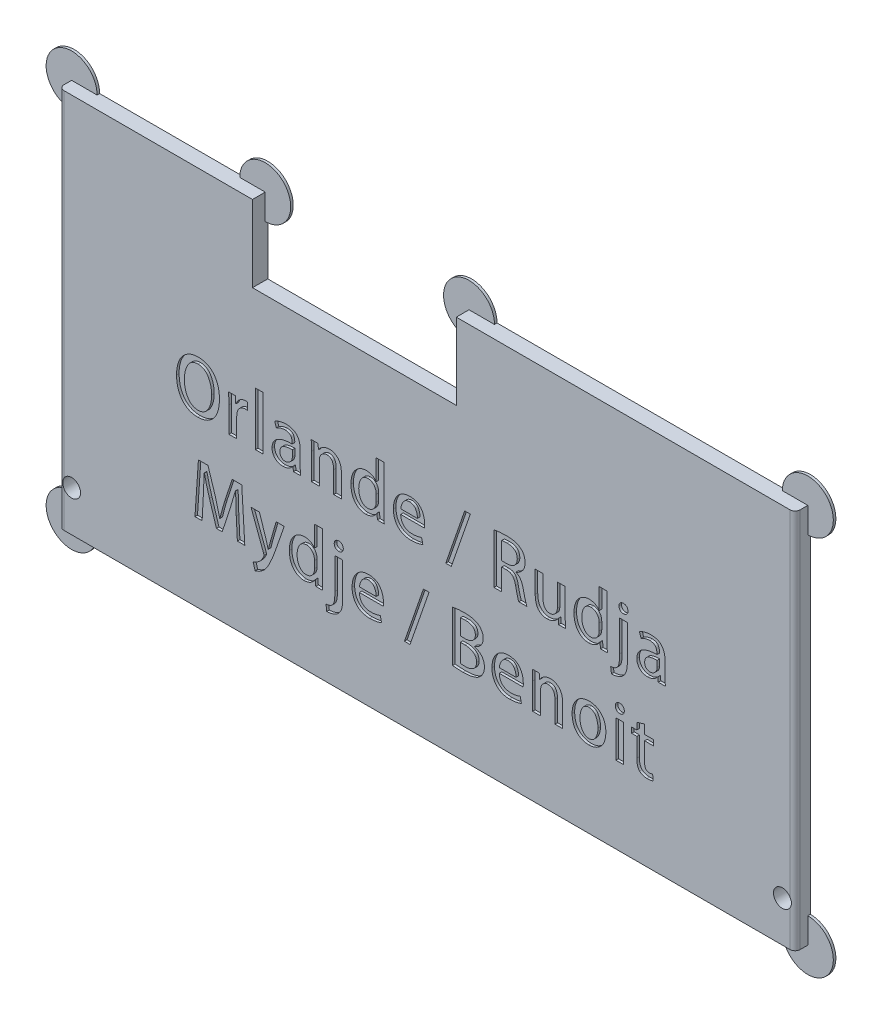
from build123d import *

# Parameters (mm, degrees)
SKETCH1_W               = 144.5
SKETCH1_H               = 149.5
BOSS_EXTRUDE1_DEPTH     = 3
CUT_EXTRUDE1_REACH      = 106.003
SKETCH2_W               = 40
SKETCH2_H               = 30
ESQUISSE1_W             = 144.5
ESQUISSE1_H             = 74.75
ENL_V_MAT_EXTRU_1_DEPTH = 10
CONG_1_R                = 1
ESQUISSE2_R             = 1.75
ENL_V_MAT_EXTRU_2_DEPTH = 10
ESQUISSE3_R             = 5
BOSS_EXTRU_1_DEPTH      = 0.5
ESQUISSE4_W             = 1.534393663
ESQUISSE4_H             = 10.483749145
ESQUISSE4_H_2           = 7.209911336
ENL_V_MAT_EXTRU_5_DEPTH = 0.5


with BuildPart() as part:
    # Sketch1 → Boss-Extrude1 (new body)
    with BuildSketch(Plane.XY):
        Rectangle(SKETCH1_W, SKETCH1_H)
    extrude(amount=BOSS_EXTRUDE1_DEPTH)

    # Sketch2 → Cut-Extrude1 (cut, up to next)
    with BuildSketch(Plane.XY.offset(3), mode=Mode.PRIVATE) as cut_extrude1_sk1:
        with Locations((-14.25, 0)):
            Rectangle(SKETCH2_W, SKETCH2_H)
    cut_extrude1_tool1 = extrude(cut_extrude1_sk1.sketch, amount=-CUT_EXTRUDE1_REACH, mode=Mode.PRIVATE) & part.part
    add(cut_extrude1_tool1.solids().sort_by_distance((-14.25, 0, 3))[0], mode=Mode.SUBTRACT)

    # Esquisse1 → Enlèv. mat.-Extru.1 (cut)
    with BuildSketch(Plane.XY.offset(3)):
        with Locations((0, 37.375)):
            Rectangle(ESQUISSE1_W, ESQUISSE1_H)
    extrude(amount=-ENL_V_MAT_EXTRU_1_DEPTH, mode=Mode.SUBTRACT)

    # Congé1
    cong_1_edges = [part.edges().sort_by_distance(p)[0] for p in [
        (-72.25, -37.375, 3),
        (72.25, -37.375, 3),
    ]]
    fillet(cong_1_edges, radius=CONG_1_R)

    # Esquisse2 → Enlèv. mat.-Extru.2 (cut)
    with BuildSketch(Plane(origin=(0, 0, 0), x_dir=(-1, 0, 0), z_dir=(0, 0, -1))):
        with Locations((69.75, -66.75)):
            Circle(ESQUISSE2_R)
        with Locations(Location((-69.75, -66.75, 0), (0, 0, 148.997280866))):
            Circle(ESQUISSE2_R)
    extrude(amount=-ENL_V_MAT_EXTRU_2_DEPTH, mode=Mode.SUBTRACT)

    # Esquisse3 → Boss.-Extru.1 (add)
    with BuildSketch(Plane(origin=(0, 0, 0), x_dir=(-1, 0, 0), z_dir=(0, 0, -1))):
        with Locations((72.25, 0)):
            Circle(ESQUISSE3_R)
        with Locations((72.25, -74.75)):
            Circle(ESQUISSE3_R)
        with Locations((-72.25, -74.75)):
            Circle(ESQUISSE3_R)
        with Locations((-72.25, 0)):
            Circle(ESQUISSE3_R)
        with Locations((-5.75, 0)):
            Circle(ESQUISSE3_R)
        with Locations((34.25, 0)):
            Circle(ESQUISSE3_R)
    extrude(amount=-BOSS_EXTRU_1_DEPTH)

    # Esquisse4 → Enlèv. mat.-Extru.5 (cut)
    # profile 1 of 28: a face of its own
    with BuildSketch(Plane.XY.offset(3)):
        with BuildLine():
            add(Edge.make_bspline(
                [(-44.869893095, -32.112017239), (-45.030417345, -32.118659368), (-45.343872543, -32.131629434), (-45.800505661, -32.203226336), (-46.231926286, -32.31325719), (-46.636792802, -32.469414077), (-47.01639096, -32.667100496), (-47.369319677, -32.908601567), (-47.696151171, -33.192240725), (-47.994950638, -33.516313862), (-48.262711721, -33.877795979), (-48.498858609, -34.27286323), (-48.695930181, -34.701996793), (-48.861480898, -35.161300588), (-48.988712801, -35.65307879), (-49.08295031, -36.175992149), (-49.141678577, -36.731224355), (-49.152660342, -37.112188486), (-49.158293166, -37.307594583)],
                knots=[0, 0, 0, 0, 1.01693825, 1.985772131, 2.921518734, 3.832117633, 4.727948323, 5.626511184, 6.534414133, 7.463288783, 8.412839634, 9.378967074, 10.373196777, 11.399194858, 12.46754142, 13.586614818, 14.762113956, 16, 16, 16, 16], degree=3))
            add(Edge.make_bspline(
                [(-49.158293166, -37.307594583), (-49.154241835, -37.495476877), (-49.146324177, -37.862661913), (-49.086428629, -38.397568061), (-49.003357078, -38.903887961), (-48.87791376, -39.3788909), (-48.725976706, -39.826437208), (-48.532681703, -40.241183552), (-48.311799206, -40.629001131), (-48.054735948, -40.982753697), (-47.770166696, -41.304312207), (-47.454441625, -41.583574544), (-47.112083166, -41.821628698), (-46.742337416, -42.017851366), (-46.345005889, -42.171028938), (-45.920988964, -42.28192261), (-45.470778659, -42.35329586), (-45.161332461, -42.36556455), (-45.002963601, -42.371843439)],
                knots=[0, 0, 0, 0, 1.222557966, 2.38928844, 3.500048728, 4.559063003, 5.583344684, 6.572073494, 7.532658458, 8.483942143, 9.413076429, 10.322121769, 11.220566177, 12.121066096, 13.040014193, 13.985715855, 14.969126498, 16, 16, 16, 16], degree=3))
            add(Edge.make_bspline(
                [(-45.002963601, -42.371843439), (-44.849693846, -42.36788053), (-44.548858169, -42.36010219), (-44.108987795, -42.298113409), (-43.690588778, -42.198997769), (-43.294829447, -42.056708848), (-42.92225689, -41.871540171), (-42.570802701, -41.647871956), (-42.241979578, -41.382379424), (-41.934694556, -41.07874217), (-41.65864801, -40.731000019), (-41.41418835, -40.343039066), (-41.21161182, -39.910304691), (-41.041584217, -39.438428835), (-40.907716615, -38.924797264), (-40.81136039, -38.370493363), (-40.74803083, -37.774479154), (-40.73645504, -37.363189059), (-40.73047604, -37.15075404)],
                knots=[0, 0, 0, 0, 0.964759122, 1.89361537, 2.791129421, 3.668077106, 4.535429534, 5.405715028, 6.285894481, 7.191747456, 8.120239528, 9.075412678, 10.072429751, 11.12252868, 12.229792465, 13.410030886, 14.662257747, 16, 16, 16, 16], degree=3))
            add(Edge.make_bspline(
                [(-40.73047604, -37.15075404), (-40.733609468, -36.969858193), (-40.739736543, -36.616136135), (-40.791433264, -36.098819909), (-40.876761858, -35.608437332), (-40.990980336, -35.142773568), (-41.140132603, -34.703054708), (-41.323854619, -34.289502651), (-41.540738884, -33.902180336), (-41.785993629, -33.540818512), (-42.066391854, -33.214522968), (-42.377057436, -32.927622249), (-42.718385253, -32.682252251), (-43.092163497, -32.484840538), (-43.493685416, -32.323458333), (-43.926847045, -32.210563052), (-44.388830712, -32.13494071), (-44.707246576, -32.120415804), (-44.870688444, -32.112960216)],
                knots=[0, 0, 0, 0, 1.181997023, 2.311265979, 3.393394717, 4.432710499, 5.441572568, 6.423779709, 7.385757606, 8.339154063, 9.273212536, 10.190881701, 11.096730823, 12.012033381, 12.946898792, 13.918455472, 14.931549697, 16, 16, 16, 16], degree=3))
            Line((-44.870688444, -32.112960216), (-44.869893095, -32.112017239))
        make_face()
        with BuildLine():
            add(Edge.make_bspline(
                [(-44.922825302, -33.300607694), (-44.813813111, -33.309928675), (-44.600713353, -33.328149561), (-44.291971363, -33.394316799), (-44.005261077, -33.496257464), (-43.740303412, -33.633818938), (-43.499582974, -33.808041846), (-43.277592261, -34.013473388), (-43.080563459, -34.255937582), (-42.909329035, -34.530281644), (-42.758058493, -34.825249802), (-42.626466793, -35.133932996), (-42.511243582, -35.451801673), (-42.422123742, -35.782197902), (-42.348855412, -36.121879775), (-42.301504755, -36.473214637), (-42.269512426, -36.834585267), (-42.266430304, -37.079504904), (-42.264867857, -37.203664103)],
                knots=[0, 0, 0, 0, 0.999589655, 1.954022852, 2.877517249, 3.773878129, 4.673599429, 5.586311784, 6.531597741, 7.520501744, 8.537853166, 9.559417173, 10.586727125, 11.626167667, 12.685579831, 13.761408337, 14.865171654, 16, 16, 16, 16], degree=3))
            add(Edge.make_bspline(
                [(-42.264867857, -37.203664103), (-42.267315699, -37.339136213), (-42.272115064, -37.604749771), (-42.30182634, -37.995507646), (-42.355011641, -38.369614455), (-42.427780113, -38.728591151), (-42.525159418, -39.070185547), (-42.639039547, -39.397149679), (-42.778677073, -39.705886746), (-42.93466817, -39.997788469), (-43.113458543, -40.265014121), (-43.313513978, -40.500749326), (-43.535750674, -40.702295664), (-43.778174823, -40.869469076), (-44.042322616, -41.001424575), (-44.326754611, -41.096928183), (-44.630942883, -41.163766815), (-44.841986885, -41.176656444), (-44.950053538, -41.183256674)],
                knots=[0, 0, 0, 0, 1.215141369, 2.382468418, 3.512223075, 4.602497428, 5.664896563, 6.695933009, 7.704955915, 8.700973005, 9.661508233, 10.583141316, 11.467103885, 12.344670232, 13.216342825, 14.106081872, 15.030205112, 16, 16, 16, 16], degree=3))
            add(Edge.make_bspline(
                [(-44.950053538, -41.183256674), (-45.056208171, -41.175794664), (-45.264024078, -41.161186499), (-45.564842854, -41.095281887), (-45.846686805, -40.997614454), (-46.107384039, -40.863772581), (-46.349166612, -40.697806738), (-46.568179602, -40.494984018), (-46.771091615, -40.261108302), (-46.947102192, -39.992537946), (-47.104912493, -39.702383374), (-47.242483945, -39.395745733), (-47.360957776, -39.075433039), (-47.453655345, -38.739886291), (-47.530703916, -38.39202673), (-47.582210163, -38.030032804), (-47.615463779, -37.654652333), (-47.61980277, -37.399630528), (-47.622011703, -37.269801681)],
                knots=[0, 0, 0, 0, 0.968573833, 1.896149455, 2.796477749, 3.679461465, 4.558257033, 5.460120664, 6.392036362, 7.372592241, 8.379386201, 9.399199485, 10.432362265, 11.48798156, 12.568687675, 13.676620176, 14.817192429, 16, 16, 16, 16], degree=3))
            add(Edge.make_bspline(
                [(-47.622011703, -37.269801681), (-47.621223669, -37.143123092), (-47.6196648, -36.892530753), (-47.587280035, -36.522981828), (-47.5398377, -36.163529479), (-47.467112212, -35.816748114), (-47.376793082, -35.480696382), (-47.265217252, -35.15579799), (-47.130461963, -34.843313444), (-46.979759834, -34.543072196), (-46.806783796, -34.265628604), (-46.606625598, -34.020579326), (-46.382726243, -33.811640016), (-46.135729882, -33.6368293), (-45.865002418, -33.498521065), (-45.571688234, -33.394253173), (-45.255371345, -33.32492701), (-45.036066155, -33.309472575), (-44.923598507, -33.301546981)],
                knots=[0, 0, 0, 0, 1.136547726, 2.248289582, 3.326834991, 4.389002452, 5.425786828, 6.448433384, 7.469124786, 8.477926495, 9.461316408, 10.397265518, 11.309260955, 12.201738065, 13.104381261, 14.028854752, 14.989125284, 16, 16, 16, 16], degree=3))
            Line((-44.923598507, -33.301546981), (-44.922825302, -33.300607694))
        make_face(mode=Mode.SUBTRACT)
    # profile 2 of 28: a face of its own
    with BuildSketch(Plane.XY.offset(3)):
        with BuildLine():
            add(Edge.make_bspline(
                [(-35.239451577, -34.929590643), (-35.300937059, -34.91891361), (-35.426514858, -34.897106865), (-35.553947212, -34.894141575), (-35.618986056, -34.892628151)],
                knots=[0, 0, 0, 0, 0.97924127, 2, 2, 2, 2], degree=3))
            add(Edge.make_bspline(
                [(-35.618986056, -34.892628151), (-35.717707831, -34.898020607), (-35.913507897, -34.908715748), (-36.200137543, -34.985691173), (-36.472640681, -35.111015358), (-36.731052088, -35.279669235), (-36.97062855, -35.488660909), (-37.176203082, -35.742178672), (-37.356232082, -36.029893909), (-37.443125774, -36.243429227), (-37.487845056, -36.35332381)],
                knots=[0, 0, 0, 0, 0.938175605, 1.860732817, 2.801619752, 3.780189859, 4.786007179, 5.811395864, 6.873648904, 8, 8, 8, 8], degree=3))
            Line((-37.487845056, -36.35332381), (-37.540755119, -36.352995337))
            Line((-37.540755119, -36.352995337), (-37.593665181, -35.046030795))
            Line((-37.593665181, -35.046030795), (-38.928981781, -35.046030795))
            add(Edge.make_bspline(
                [(-38.928981781, -35.046030795), (-38.920290753, -35.213436878), (-38.902549607, -35.55516581), (-38.889143473, -36.082417779), (-38.878525508, -36.642394929), (-38.878590222, -37.027920709), (-38.878623846, -37.228229489)],
                knots=[0, 0, 0, 0, 0.921405029, 1.880880017, 2.898962507, 4, 4, 4, 4], degree=3))
            Line((-38.878623846, -37.228229489), (-38.876736046, -42.230640448))
            Line((-38.876736046, -42.230640448), (-37.342342384, -42.230640448))
            Line((-37.342342384, -42.230640448), (-37.342342384, -38.416701842))
            add(Edge.make_bspline(
                [(-37.342342384, -38.416701842), (-37.33998964, -38.339228162), (-37.33540884, -38.188386607), (-37.315411736, -37.967863501), (-37.279373662, -37.760138672), (-37.230362654, -37.5641996), (-37.167772831, -37.380318975), (-37.09312158, -37.207302804), (-37.001403519, -37.048836147), (-36.899479461, -36.901759638), (-36.784454121, -36.770367541), (-36.659791321, -36.653113987), (-36.521340066, -36.556717741), (-36.374517012, -36.474342302), (-36.215579093, -36.41293161), (-36.048414587, -36.364253223), (-35.869954354, -36.336367588), (-35.747571784, -36.331329307), (-35.685123635, -36.328758424)],
                knots=[0, 0, 0, 0, 1.241840886, 2.417868999, 3.544527356, 4.616704577, 5.650820151, 6.654086497, 7.630544836, 8.5797601, 9.516878827, 10.423948895, 11.314471818, 12.213419717, 13.114913654, 14.038234368, 14.998969914, 16, 16, 16, 16], degree=3))
            add(Edge.make_bspline(
                [(-35.685123635, -36.328758424), (-35.606213687, -36.329921733), (-35.457276332, -36.332117402), (-35.310206413, -36.355538968), (-35.241057037, -36.366551326)],
                knots=[0, 0, 0, 0, 1.059639438, 2, 2, 2, 2], degree=3))
            Line((-35.241057037, -36.366551326), (-35.239451577, -34.929590643))
        make_face()
    # profile 3 of 28: a face of its own
    with BuildSketch(Plane.XY.offset(3)):
        with Locations((-32.909235913, -36.999583356)):
            Rectangle(ESQUISSE4_W, ESQUISSE4_H)
    # profile 4 of 28: a face of its own
    with BuildSketch(Plane.XY.offset(3)):
        with BuildLine():
            add(Edge.make_bspline(
                [(-24.885803759, -37.867614159), (-24.885684685, -37.767193728), (-24.885450202, -37.569445357), (-24.90878119, -37.278123979), (-24.949849871, -36.998324815), (-25.00989994, -36.730059027), (-25.091857374, -36.474406492), (-25.191565232, -36.230084207), (-25.311669914, -35.99800866), (-25.450112143, -35.777996738), (-25.614659171, -35.575634292), (-25.809558353, -35.397863296), (-26.0353474, -35.247637462), (-26.291548449, -35.125032834), (-26.577047855, -35.027169041), (-26.891678695, -34.954333827), (-27.235777177, -34.90668831), (-27.475085036, -34.897433299), (-27.599332271, -34.892628151)],
                knots=[0, 0, 0, 0, 1.04529413, 2.058397975, 3.039753549, 3.988049356, 4.917306062, 5.832005784, 6.732558164, 7.634995369, 8.534400609, 9.439717093, 10.371077683, 11.347885902, 12.389132223, 13.507522911, 14.705920534, 16, 16, 16, 16], degree=3))
            add(Edge.make_bspline(
                [(-27.599332271, -34.892628151), (-27.714042026, -34.895681655), (-27.940113825, -34.901699548), (-28.272228031, -34.933864812), (-28.591254317, -34.986206917), (-28.893512319, -35.060675036), (-29.177294747, -35.146813049), (-29.439106097, -35.242572412), (-29.676509872, -35.349227526), (-29.821523862, -35.432555642), (-29.891471772, -35.472749196)],
                knots=[0, 0, 0, 0, 1.151566781, 2.269526023, 3.346377101, 4.393757963, 5.391790339, 6.321988655, 7.190606464, 8, 8, 8, 8], degree=3))
            Line((-29.891471772, -35.472749196), (-29.5705126, -36.491803055))
            add(Edge.make_bspline(
                [(-29.5705126, -36.491803055), (-29.509885885, -36.452869801), (-29.387590641, -36.37433426), (-29.191162628, -36.272783457), (-28.984128717, -36.181276775), (-28.765321148, -36.107584536), (-28.541202078, -36.044196852), (-28.313177707, -35.999028208), (-28.082483742, -35.971775268), (-27.928203088, -35.9678963), (-27.850655069, -35.965946566)],
                knots=[0, 0, 0, 0, 0.947728913, 1.911743672, 2.906591377, 3.923705885, 4.947352295, 5.969890554, 6.979580645, 8, 8, 8, 8], degree=3))
            add(Edge.make_bspline(
                [(-27.850655069, -35.965946566), (-27.771097641, -35.971193997), (-27.619244447, -35.981209896), (-27.404906851, -36.021846622), (-27.214704513, -36.07587088), (-27.047185476, -36.144578183), (-26.905269825, -36.234912623), (-26.786575077, -36.340635486), (-26.692676538, -36.464372808), (-26.609269159, -36.649343708), (-26.537797877, -36.88421305), (-26.474777419, -37.15814158), (-26.445694726, -37.420469889), (-26.453957784, -37.589756433), (-26.457986634, -37.672296087)],
                knots=[0, 0, 0, 0, 1.124941475, 2.147203117, 3.073276344, 3.914150165, 4.693859246, 5.436944029, 6.148486199, 6.868538222, 8.288979618, 9.609682438, 10.834544209, 12, 12, 12, 12], degree=3))
            add(Edge.make_bspline(
                [(-26.457986634, -37.672296087), (-26.604156212, -37.674128962), (-26.889852869, -37.67771142), (-27.307046348, -37.705016732), (-27.700636593, -37.756334035), (-28.070946994, -37.82648521), (-28.419292754, -37.913097182), (-28.743341259, -38.025928409), (-29.045490467, -38.155716121), (-29.323528515, -38.306028656), (-29.574967677, -38.477434085), (-29.794119777, -38.672663109), (-29.978907099, -38.891070183), (-30.134733537, -39.128548424), (-30.25329724, -39.391216329), (-30.342714587, -39.673826855), (-30.397983208, -39.979378114), (-30.407906744, -40.190335257), (-30.413013818, -40.29890277)],
                knots=[0, 0, 0, 0, 1.312583045, 2.565517338, 3.751913568, 4.874585872, 5.948775456, 6.97196923, 7.952367169, 8.899011352, 9.80588498, 10.679130641, 11.525793372, 12.368308044, 13.221239438, 14.104974037, 15.024739096, 16, 16, 16, 16], degree=3))
            add(Edge.make_bspline(
                [(-30.413013818, -40.29890277), (-30.410280002, -40.369513151), (-30.404915924, -40.50805922), (-30.379096302, -40.712097565), (-30.332322247, -40.906909949), (-30.273370171, -41.095201298), (-30.192506432, -41.273715614), (-30.096115109, -41.443668652), (-29.9837545, -41.606320434), (-29.853852111, -41.758053561), (-29.709371625, -41.898866177), (-29.547128209, -42.019739471), (-29.372359463, -42.12413751), (-29.184084202, -42.212178447), (-28.980222341, -42.27945583), (-28.762787743, -42.330568969), (-28.530553237, -42.362674329), (-28.371035708, -42.369978932), (-28.289052731, -42.373733084)],
                knots=[0, 0, 0, 0, 1.019558823, 2.000497171, 2.961865832, 3.90763667, 4.843526869, 5.78386522, 6.724423229, 7.691661655, 8.662438953, 9.629634663, 10.603980382, 11.596308817, 12.622532153, 13.696327026, 14.81604254, 16, 16, 16, 16], degree=3))
            add(Edge.make_bspline(
                [(-28.289052731, -42.373733084), (-28.183590551, -42.37015408), (-27.977596942, -42.363163404), (-27.680221152, -42.307288015), (-27.400408714, -42.228062192), (-27.143491996, -42.111598503), (-26.910210555, -41.969208978), (-26.697805454, -41.810180437), (-26.510384387, -41.630292399), (-26.405986747, -41.494545546), (-26.354056153, -41.427020892)],
                knots=[0, 0, 0, 0, 1.130657597, 2.208452709, 3.237069398, 4.244418774, 5.223812689, 6.164576675, 7.087004055, 8, 8, 8, 8], degree=3))
            Line((-26.354056153, -41.427020892), (-26.311507768, -41.426649975))
            Line((-26.311507768, -41.426649975), (-26.2028827, -42.234827562))
            Line((-26.2028827, -42.234827562), (-24.781312291, -42.234827562))
            add(Edge.make_bspline(
                [(-24.781312291, -42.234827562), (-24.801702929, -42.112558123), (-24.844762552, -41.854357481), (-24.871600677, -41.445018442), (-24.886311826, -41.005768054), (-24.887226006, -40.703936018), (-24.887691559, -40.550225567)],
                knots=[0, 0, 0, 0, 0.879539962, 1.857355241, 2.908840502, 4, 4, 4, 4], degree=3))
            Line((-24.887691559, -40.550225567), (-24.885803759, -37.867614159))
        make_face()
        with BuildLine():
            add(Edge.make_bspline(
                [(-26.420195577, -39.824099914), (-26.423042035, -39.877270192), (-26.428580878, -39.980732731), (-26.452371785, -40.131795587), (-26.484834507, -40.275361194), (-26.533741662, -40.410721154), (-26.591396327, -40.540041798), (-26.664157107, -40.660932841), (-26.747393312, -40.775598219), (-26.843949871, -40.880450635), (-26.948566788, -40.97644964), (-27.061150224, -41.059783697), (-27.178187807, -41.132433136), (-27.302667196, -41.191155882), (-27.433352904, -41.239039468), (-27.570957731, -41.272378874), (-27.714605915, -41.293623433), (-27.81215975, -41.298118477), (-27.861992939, -41.30041467)],
                knots=[0, 0, 0, 0, 1.1127689, 2.165305488, 3.194083487, 4.185588777, 5.169981375, 6.15040018, 7.13046498, 8.12816315, 9.12586132, 10.095335325, 11.053196287, 12.001774197, 12.968470205, 13.958837393, 14.957317833, 16, 16, 16, 16], degree=3))
            add(Edge.make_bspline(
                [(-27.861992939, -41.30041467), (-27.92916117, -41.29830822), (-28.06073011, -41.294182113), (-28.249311969, -41.23791122), (-28.422763838, -41.149663178), (-28.579815425, -41.026352596), (-28.711316426, -40.862105412), (-28.805535195, -40.656076753), (-28.863818273, -40.411605995), (-28.872248942, -40.235640395), (-28.876732356, -40.142062227)],
                knots=[0, 0, 0, 0, 0.925162071, 1.812204857, 2.691873356, 3.602553412, 4.549923018, 5.56994314, 6.707700436, 8, 8, 8, 8], degree=3))
            add(Edge.make_bspline(
                [(-28.876732356, -40.142062227), (-28.870748637, -40.066926771), (-28.85919161, -39.921809228), (-28.816821555, -39.714022446), (-28.747638309, -39.526951849), (-28.658920525, -39.359108275), (-28.548298406, -39.209989096), (-28.411389564, -39.085361315), (-28.255117122, -38.977255244), (-28.014644826, -38.867128237), (-27.69048034, -38.763099682), (-27.284237146, -38.673793122), (-26.858527413, -38.625428429), (-26.569589423, -38.626182102), (-26.422083377, -38.62656686)],
                knots=[0, 0, 0, 0, 0.831751151, 1.606454387, 2.332498033, 3.02628555, 3.696675427, 4.370806108, 5.061344671, 5.786088267, 7.281491765, 8.811961156, 10.372470837, 12, 12, 12, 12], degree=3))
            Line((-26.422083377, -38.62656686), (-26.420195577, -39.824099914))
        make_face(mode=Mode.SUBTRACT)
    # profile 5 of 28: a face of its own
    with BuildSketch(Plane.XY.offset(3)):
        with BuildLine():
            add(Edge.make_bspline(
                [(-16.78300559, -37.780149795), (-16.788924288, -37.650857344), (-16.800385776, -37.400484062), (-16.843615913, -37.040457689), (-16.907172842, -36.709894439), (-16.991133793, -36.409434347), (-17.098203777, -36.139722434), (-17.228070645, -35.900959211), (-17.37613337, -35.689756181), (-17.551313864, -35.515136475), (-17.735042855, -35.364013421), (-17.924279558, -35.233536345), (-18.117425318, -35.121933437), (-18.317318902, -35.036139884), (-18.519515798, -34.966004034), (-18.727160687, -34.92230164), (-18.938245809, -34.893080203), (-19.08071158, -34.894035584), (-19.152618694, -34.894517796)],
                knots=[0, 0, 0, 0, 1.4740216, 2.854425156, 4.126558204, 5.305357651, 6.403288682, 7.424341756, 8.396099549, 9.329729996, 10.231921487, 11.1036965, 11.945638075, 12.768185098, 13.578243716, 14.37909755, 15.181877752, 16, 16, 16, 16], degree=3))
            add(Edge.make_bspline(
                [(-19.152618694, -34.894517796), (-19.279582589, -34.901387087), (-19.524107627, -34.91461694), (-19.874945921, -34.985991926), (-20.194673308, -35.095840542), (-20.479218825, -35.249551562), (-20.728569815, -35.428045603), (-20.944559238, -35.623238089), (-21.129805099, -35.82926547), (-21.223323648, -35.983280298), (-21.269021201, -36.058539175)],
                knots=[0, 0, 0, 0, 1.205968632, 2.322625085, 3.38758246, 4.404339688, 5.38188705, 6.29234413, 7.165559161, 8, 8, 8, 8], degree=3))
            Line((-21.269021201, -36.058539175), (-21.308703748, -36.057402436))
            Line((-21.308703748, -36.057402436), (-21.388068842, -35.04220168))
            Line((-21.388068842, -35.04220168), (-22.723385442, -35.04220168))
            add(Edge.make_bspline(
                [(-22.723385442, -35.04220168), (-22.717146392, -35.189491148), (-22.704371846, -35.491068486), (-22.690728032, -35.873957749), (-22.679327123, -36.195797409), (-22.67726732, -36.454112258), (-22.671866694, -36.727455464), (-22.672632843, -36.914545232), (-22.673027507, -37.010920303)],
                knots=[0, 0, 0, 0, 1.347277785, 2.758570962, 3.50151606, 4.290240264, 5.119255866, 6, 6, 6, 6], degree=3))
            Line((-22.673027507, -37.010920303), (-22.671139708, -42.181852911))
            Line((-22.671139708, -42.181852911), (-21.136746045, -42.181852911))
            Line((-21.136746045, -42.181852911), (-21.136746045, -37.845456963))
            add(Edge.make_bspline(
                [(-21.136746045, -37.845456963), (-21.133436987, -37.775670119), (-21.126995576, -37.639823082), (-21.099352443, -37.443267125), (-21.063382944, -37.258648822), (-21.009289322, -37.087631957), (-20.944415099, -36.928679822), (-20.863556494, -36.783526196), (-20.771435854, -36.650287632), (-20.664890097, -36.532398825), (-20.552323909, -36.425941122), (-20.432525493, -36.336274477), (-20.311375575, -36.256510389), (-20.184281916, -36.195228638), (-20.054889252, -36.145204957), (-19.922085849, -36.108814724), (-19.785055368, -36.087877098), (-19.692496367, -36.084704566), (-19.645816064, -36.083104561)],
                knots=[0, 0, 0, 0, 1.303341954, 2.537084838, 3.701489476, 4.809632544, 5.879507328, 6.90039329, 7.90496914, 8.895969017, 9.860891884, 10.792062371, 11.685661513, 12.563734899, 13.419647646, 14.272405465, 15.128721849, 16, 16, 16, 16], degree=3))
            add(Edge.make_bspline(
                [(-19.645816064, -36.083104561), (-19.586462476, -36.08614493), (-19.471408214, -36.092038549), (-19.306732944, -36.122998041), (-19.154769977, -36.168117249), (-19.016819104, -36.23035644), (-18.892347655, -36.3081141), (-18.782948442, -36.403042864), (-18.685328417, -36.512615287), (-18.578026113, -36.685418161), (-18.468854132, -36.926687381), (-18.37674055, -37.244763197), (-18.323133746, -37.594241791), (-18.32060091, -37.837130732), (-18.319285207, -37.963301431)],
                knots=[0, 0, 0, 0, 0.82045112, 1.590407583, 2.3090629, 3.006369623, 3.675284288, 4.32954105, 5.001788588, 5.694735739, 7.131861874, 8.646725831, 10.258113576, 12, 12, 12, 12], degree=3))
            Line((-18.319285207, -37.963301431), (-18.317397408, -42.181852911))
            Line((-18.317397408, -42.181852911), (-16.78300559, -42.181852911))
            Line((-16.78300559, -42.181852911), (-16.78300559, -37.780149795))
        make_face()
    # profile 6 of 28: a face of its own
    with BuildSketch(Plane.XY.offset(3)):
        with BuildLine():
            Line((-8.438332848, -31.771890348), (-9.972726511, -31.771890348))
            Line((-9.972726511, -31.771890348), (-9.972726511, -35.849615289))
            Line((-9.972726511, -35.849615289), (-9.999037605, -35.849615289))
            add(Edge.make_bspline(
                [(-9.999037605, -35.849615289), (-10.042502423, -35.78237012), (-10.130323314, -35.646500903), (-10.300847975, -35.466089144), (-10.499899163, -35.303019858), (-10.730330023, -35.161124897), (-10.988460901, -35.04313032), (-11.276510095, -34.961426977), (-11.589528548, -34.90727706), (-11.807958455, -34.898867735), (-11.920946914, -34.894517796)],
                knots=[0, 0, 0, 0, 0.854597497, 1.726718703, 2.640789565, 3.599543774, 4.612294015, 5.665075704, 6.79220066, 8, 8, 8, 8], degree=3))
            add(Edge.make_bspline(
                [(-11.920946914, -34.894517796), (-12.023212095, -34.897743885), (-12.225159522, -34.904114579), (-12.520620941, -34.955920594), (-12.805219711, -35.032202708), (-13.076645735, -35.143481963), (-13.336745533, -35.283544005), (-13.583859113, -35.455505456), (-13.818719793, -35.657352602), (-14.041565499, -35.886539106), (-14.244477917, -36.146371733), (-14.422172934, -36.434800774), (-14.574171045, -36.750784261), (-14.697678131, -37.094475427), (-14.798145811, -37.464026094), (-14.870858515, -37.860348857), (-14.918293045, -38.283475318), (-14.929274898, -38.574792422), (-14.934930841, -38.724828405)],
                knots=[0, 0, 0, 0, 0.900512761, 1.778281058, 2.635992154, 3.492463302, 4.356668303, 5.234226012, 6.139634244, 7.081658826, 8.046461591, 9.038373575, 10.061110518, 11.13039217, 12.251937016, 13.431943807, 14.677383403, 16, 16, 16, 16], degree=3))
            add(Edge.make_bspline(
                [(-14.934930841, -38.724828405), (-14.930584936, -38.862272112), (-14.922111172, -39.130263552), (-14.877047493, -39.520866545), (-14.812796492, -39.889492184), (-14.7219066, -40.235326116), (-14.606783071, -40.558058378), (-14.46685235, -40.858319826), (-14.301632809, -41.135165917), (-14.115064463, -41.389067994), (-13.907658297, -41.614985488), (-13.685190783, -41.812828893), (-13.44966802, -41.983655799), (-13.197204106, -42.121554132), (-12.930646568, -42.229652707), (-12.650854914, -42.309629833), (-12.356072505, -42.359872709), (-12.154201879, -42.367802545), (-12.051332425, -42.371843439)],
                knots=[0, 0, 0, 0, 1.26891998, 2.474174334, 3.626144234, 4.720590941, 5.770785917, 6.785266233, 7.773494989, 8.742235728, 9.688787206, 10.599011985, 11.486517991, 12.368693698, 13.247624935, 14.136577384, 15.05043507, 16, 16, 16, 16], degree=3))
            add(Edge.make_bspline(
                [(-12.051332425, -42.371843439), (-11.926228205, -42.367182676), (-11.682915752, -42.35811806), (-11.332606669, -42.286131053), (-11.005710809, -42.183589243), (-10.710809865, -42.031521913), (-10.44518922, -41.849940367), (-10.211555426, -41.641541122), (-10.010301049, -41.407266386), (-9.907216101, -41.231595157), (-9.855564825, -41.143574127)],
                knots=[0, 0, 0, 0, 1.135235608, 2.20789483, 3.237344347, 4.237768545, 5.208957197, 6.153023719, 7.074562442, 8, 8, 8, 8], degree=3))
            Line((-9.855564825, -41.143574127), (-9.813994478, -41.142876582))
            Line((-9.813994478, -41.142876582), (-9.734629384, -42.231812249))
            Line((-9.734629384, -42.231812249), (-8.386087114, -42.231812249))
            add(Edge.make_bspline(
                [(-8.386087114, -42.231812249), (-8.389802761, -42.167008136), (-8.397524751, -42.032329937), (-8.406400006, -41.821334988), (-8.416477563, -41.593362469), (-8.425824993, -41.26643457), (-8.435815529, -40.847581446), (-8.438754198, -40.510549703), (-8.440220648, -40.342364607)],
                knots=[0, 0, 0, 0, 0.618047772, 1.284448733, 2.01076926, 2.79081724, 4.39855823, 6, 6, 6, 6], degree=3))
            Line((-8.440220648, -40.342364607), (-8.438332848, -31.771890348))
        make_face()
        with BuildLine():
            add(Edge.make_bspline(
                [(-9.972726511, -39.302650135), (-9.975651483, -39.366473419), (-9.981424624, -39.492444123), (-10.004619499, -39.676858102), (-10.037365211, -39.854344625), (-10.087780692, -40.023332072), (-10.149183081, -40.185621996), (-10.22561994, -40.339717368), (-10.314711486, -40.485843082), (-10.416453577, -40.623094667), (-10.528509899, -40.750326157), (-10.65451463, -40.860143811), (-10.789076337, -40.954558527), (-10.932341611, -41.036253651), (-11.087243468, -41.09751425), (-11.251428737, -41.142686829), (-11.424717949, -41.174263934), (-11.544137438, -41.180208354), (-11.605376183, -41.183256674)],
                knots=[0, 0, 0, 0, 1.104390879, 2.179782793, 3.211540782, 4.221450311, 5.224759824, 6.208727191, 7.191307031, 8.180325351, 9.159942602, 10.116955204, 11.062807837, 11.999079415, 12.96183915, 13.934345961, 14.940725149, 16, 16, 16, 16], degree=3))
            add(Edge.make_bspline(
                [(-11.605376183, -41.183256674), (-11.676097063, -41.179191956), (-11.814093928, -41.171260517), (-12.013863717, -41.132695798), (-12.200537501, -41.074270323), (-12.374929642, -40.994195514), (-12.535248906, -40.891887442), (-12.683306812, -40.768861807), (-12.817574647, -40.624502645), (-12.937801802, -40.459394851), (-13.044808732, -40.278774136), (-13.137045362, -40.084796899), (-13.217950536, -39.879474058), (-13.280175744, -39.660698316), (-13.332631773, -39.430689482), (-13.36693052, -39.188583762), (-13.39098832, -38.934431508), (-13.393555916, -38.760792157), (-13.394870088, -38.671918342)],
                knots=[0, 0, 0, 0, 0.984741306, 1.92151474, 2.822341362, 3.700719327, 4.583284636, 5.460787722, 6.372294446, 7.31885594, 8.297337404, 9.289073803, 10.304649099, 11.364052331, 12.450586518, 13.584680478, 14.763767201, 16, 16, 16, 16], degree=3))
            add(Edge.make_bspline(
                [(-13.394870088, -38.671918342), (-13.393491636, -38.58179638), (-13.390797629, -38.405664662), (-13.367554069, -38.146875249), (-13.329835811, -37.900231479), (-13.279507549, -37.664385074), (-13.212621845, -37.441202366), (-13.134370978, -37.228795545), (-13.038463048, -37.028914503), (-12.93032199, -36.841104851), (-12.808658429, -36.668726813), (-12.671928781, -36.517854819), (-12.521216217, -36.390686633), (-12.358790721, -36.283002505), (-12.183035637, -36.197504486), (-11.992513585, -36.137330238), (-11.790236914, -36.097101421), (-11.650282428, -36.087831297), (-11.578921152, -36.083104561)],
                knots=[0, 0, 0, 0, 1.225621097, 2.395317913, 3.530655392, 4.617908651, 5.672398338, 6.697199995, 7.693566205, 8.683984347, 9.642081535, 10.557834763, 11.445297679, 12.317367365, 13.202511412, 14.093894327, 15.028097378, 16, 16, 16, 16], degree=3))
            add(Edge.make_bspline(
                [(-11.578921152, -36.083104561), (-11.52463529, -36.085040064), (-11.418030402, -36.088840944), (-11.261457434, -36.115384185), (-11.109963328, -36.151345202), (-10.965705727, -36.207068994), (-10.828246547, -36.278331964), (-10.695835844, -36.362729495), (-10.570676922, -36.464387462), (-10.451992722, -36.578519399), (-10.343764269, -36.707376811), (-10.249497358, -36.849739326), (-10.167564163, -37.004031026), (-10.099333987, -37.170963194), (-10.046287571, -37.351448187), (-10.010390024, -37.544737261), (-9.981970439, -37.749617055), (-9.977110333, -37.890760356), (-9.974612466, -37.963301431)],
                knots=[0, 0, 0, 0, 0.942650441, 1.851147651, 2.753495351, 3.643618358, 4.529426245, 5.440029814, 6.366278397, 7.325861581, 8.296795303, 9.283145519, 10.286645704, 11.327053683, 12.41081046, 13.548206592, 14.7398925, 16, 16, 16, 16], degree=3))
            Line((-9.974612466, -37.963301431), (-9.972726511, -39.302650135))
        make_face(mode=Mode.SUBTRACT)
    # profile 7 of 28: a face of its own
    with BuildSketch(Plane.XY.offset(3)):
        with BuildLine():
            add(Edge.make_bspline(
                [(-1.058761277, -40.848614183), (-1.118540503, -40.872586875), (-1.241188353, -40.92177117), (-1.433797477, -40.985445909), (-1.638176425, -41.041881035), (-1.855427776, -41.092014278), (-2.090147309, -41.131325913), (-2.344164431, -41.161985381), (-2.619291452, -41.177777712), (-2.809062322, -41.18138734), (-2.907339808, -41.183256674)],
                knots=[0, 0, 0, 0, 0.817199268, 1.676631517, 2.57260817, 3.507257618, 4.504675237, 5.591339695, 6.752616352, 8, 8, 8, 8], degree=3))
            add(Edge.make_bspline(
                [(-2.907339808, -41.183256674), (-2.981708623, -41.182430497), (-3.128235655, -41.1808027), (-3.343848071, -41.160112591), (-3.551215485, -41.122240412), (-3.75050142, -41.067424933), (-3.94122424, -40.99534793), (-4.124347992, -40.908152293), (-4.297819929, -40.803703574), (-4.463438929, -40.685206347), (-4.616501971, -40.546903281), (-4.750109174, -40.385290785), (-4.867365022, -40.203729717), (-4.962128953, -40.000125905), (-5.042836011, -39.777249025), (-5.101688442, -39.533191499), (-5.144187535, -39.268443853), (-5.155712178, -39.084653383), (-5.161686407, -38.989378718)],
                knots=[0, 0, 0, 0, 1.003942395, 1.978042825, 2.920590533, 3.847076078, 4.764893341, 5.670291816, 6.58194067, 7.495531524, 8.416653129, 9.358625048, 10.318850985, 11.326999786, 12.384286751, 13.514715768, 14.711659953, 16, 16, 16, 16], degree=3))
            Line((-5.161686407, -38.989378718), (-0.484301787, -38.987490919))
            add(Edge.make_bspline(
                [(-0.484301787, -38.987490919), (-0.473505817, -38.901301727), (-0.450167622, -38.714982179), (-0.448121503, -38.527187558), (-0.447021894, -38.42626448)],
                knots=[0, 0, 0, 0, 0.925176056, 2, 2, 2, 2], degree=3))
            add(Edge.make_bspline(
                [(-0.447021894, -38.42626448), (-0.448024253, -38.310939894), (-0.449988438, -38.084954285), (-0.47870613, -37.752098769), (-0.529356919, -37.433184955), (-0.601788052, -37.12699062), (-0.693198139, -36.833723141), (-0.809726678, -36.553942205), (-0.94761664, -36.287918915), (-1.105342449, -36.035457152), (-1.2879244, -35.803602893), (-1.49910277, -35.599474194), (-1.73833689, -35.426733632), (-2.002787286, -35.28085369), (-2.297178325, -35.171475808), (-2.615748352, -35.085784001), (-2.962239829, -35.03061033), (-3.202551466, -35.019375901), (-3.32684102, -35.013565437)],
                knots=[0, 0, 0, 0, 1.094151935, 2.144057906, 3.167074097, 4.155901624, 5.127615796, 6.078966002, 7.028060038, 7.968360286, 8.900033043, 9.821622319, 10.74584427, 11.692808832, 12.678596367, 13.71822524, 14.819862537, 16, 16, 16, 16], degree=3))
            add(Edge.make_bspline(
                [(-3.32684102, -35.013565437), (-3.454886465, -35.019489941), (-3.703917518, -35.031012299), (-4.066455153, -35.08563281), (-4.404489356, -35.175312477), (-4.722263058, -35.291211404), (-5.014232467, -35.444390545), (-5.285140082, -35.625808616), (-5.530727791, -35.842439599), (-5.75254786, -36.088019027), (-5.950834858, -36.357715034), (-6.121254906, -36.649220483), (-6.266469531, -36.958088689), (-6.389045123, -37.284194867), (-6.480204969, -37.630248976), (-6.548444857, -37.993903146), (-6.590567386, -38.37615755), (-6.596621259, -38.637168289), (-6.599706325, -38.770179887)],
                knots=[0, 0, 0, 0, 1.097034586, 2.133583726, 3.13166489, 4.087318261, 5.023228538, 5.947631796, 6.872506889, 7.819354461, 8.776133258, 9.733443889, 10.705662407, 11.695403526, 12.711892367, 13.765405017, 14.86124589, 16, 16, 16, 16], degree=3))
            add(Edge.make_bspline(
                [(-6.599706325, -38.770179887), (-6.596783416, -38.901947333), (-6.591060973, -39.159920342), (-6.54692711, -39.536666685), (-6.475451332, -39.893154843), (-6.376853599, -40.229572594), (-6.252670147, -40.546649598), (-6.099106641, -40.843330257), (-5.915811905, -41.118288106), (-5.709276274, -41.374332127), (-5.473723974, -41.603585485), (-5.213683267, -41.805368198), (-4.928026994, -41.97619113), (-4.617924837, -42.116507383), (-4.282476908, -42.225854479), (-3.923159435, -42.306338907), (-3.538686066, -42.358395159), (-3.274100598, -42.367272741), (-3.13787651, -42.371843439)],
                knots=[0, 0, 0, 0, 1.119307265, 2.191368746, 3.217819697, 4.20508808, 5.166072403, 6.106755345, 7.037398497, 7.969333271, 8.896523305, 9.823527987, 10.759678815, 11.717678244, 12.709389534, 13.751911659, 14.842552517, 16, 16, 16, 16], degree=3))
            add(Edge.make_bspline(
                [(-3.13787651, -42.371843439), (-3.014357916, -42.370106727), (-2.774585749, -42.366735451), (-2.426043141, -42.338538159), (-2.098462307, -42.300489757), (-1.792768544, -42.245261601), (-1.510401903, -42.179517309), (-1.252997292, -42.106084043), (-1.021183228, -42.02648436), (-0.879329222, -41.962195425), (-0.811723397, -41.931556132)],
                knots=[0, 0, 0, 0, 1.242786686, 2.412476118, 3.517118367, 4.560308987, 5.536651868, 6.43345837, 7.253406084, 8, 8, 8, 8], degree=3))
            Line((-0.811723397, -41.931556132), (-1.058761277, -40.848614183))
        make_face()
        with BuildLine():
            add(Edge.make_bspline(
                [(-5.147969872, -38.035107945), (-5.134788241, -37.916799385), (-5.108309803, -37.679148531), (-5.012974845, -37.330082802), (-4.874896779, -36.989637984), (-4.729088214, -36.715785237), (-4.587364283, -36.510691402), (-4.464779863, -36.374035861), (-4.326400861, -36.258110229), (-4.1767463, -36.157854995), (-4.010497117, -36.08101634), (-3.831103018, -36.022066635), (-3.637664436, -35.982084426), (-3.503389375, -35.971415954), (-3.43455079, -35.965946566)],
                knots=[0, 0, 0, 0, 1.447316192, 2.907278459, 4.386601601, 5.91334937, 6.672766172, 7.416499824, 8.140040014, 8.865203404, 9.60262621, 10.361539664, 11.160013107, 12, 12, 12, 12], degree=3))
            add(Edge.make_bspline(
                [(-3.43455079, -35.965946566), (-3.36314706, -35.970479735), (-3.224961267, -35.979252659), (-3.027778339, -36.020847629), (-2.84577832, -36.075664634), (-2.682744472, -36.154666542), (-2.534154795, -36.249003131), (-2.405815454, -36.366039122), (-2.291537261, -36.499665128), (-2.169529492, -36.704797822), (-2.046417048, -36.977963853), (-1.944194574, -37.320639182), (-1.884469357, -37.674561756), (-1.883594823, -37.913942507), (-1.883152167, -38.035107945)],
                knots=[0, 0, 0, 0, 0.882318627, 1.707528434, 2.482379625, 3.223389874, 3.937460346, 4.64796384, 5.359998226, 6.100355099, 7.58663496, 9.048269514, 10.505946221, 12, 12, 12, 12], degree=3))
            Line((-1.883152167, -38.035107945), (-5.147969872, -38.035107945))
        make_face(mode=Mode.SUBTRACT)
    # profile 8 of 28: a face of its own
    with BuildSketch(Plane.XY.offset(3)):
        Polygon((8.504226923, -32.109182771), (7.399338149, -32.109182771), (3.68185264, -42.857482229), (4.773602475, -42.857482229), align=None)
    # profile 9 of 28: a face of its own
    with BuildSketch(Plane.XY.offset(3)):
        with BuildLine():
            add(Edge.make_bspline(
                [(17.447195626, -37.501871874), (17.510829366, -37.478399172), (17.637150796, -37.431802738), (17.818247048, -37.34521151), (17.993580364, -37.251352271), (18.159273751, -37.144047659), (18.315121346, -37.023634991), (18.462835666, -36.892947864), (18.602860872, -36.751332674), (18.733392671, -36.598195041), (18.852586594, -36.434532249), (18.956478103, -36.259809695), (19.04729502, -36.075411341), (19.116540835, -35.878569817), (19.177563843, -35.673569398), (19.216744265, -35.457387173), (19.247386227, -35.231710558), (19.252041055, -35.077294929), (19.254417872, -34.998448277)],
                knots=[0, 0, 0, 0, 0.984448908, 1.954261881, 2.912051287, 3.871106542, 4.816984922, 5.769562366, 6.733317195, 7.706618018, 8.689159246, 9.669611908, 10.655553532, 11.668369991, 12.696152468, 13.758167005, 14.855290571, 16, 16, 16, 16], degree=3))
            add(Edge.make_bspline(
                [(19.254417872, -34.998448277), (19.252088209, -34.897510571), (19.247526481, -34.699863719), (19.205716248, -34.412366148), (19.145249868, -34.140082455), (19.05557401, -33.885529618), (18.941335846, -33.647389879), (18.803070322, -33.424744686), (18.638206159, -33.219500313), (18.511295979, -33.098023594), (18.447539416, -33.036996668)],
                knots=[0, 0, 0, 0, 1.106785191, 2.167204112, 3.181420928, 4.162778401, 5.120989717, 6.07402843, 7.032439092, 8, 8, 8, 8], degree=3))
            add(Edge.make_bspline(
                [(18.447539416, -33.036996668), (18.36669248, -32.97041195), (18.202666806, -32.835322067), (17.919436725, -32.672344128), (17.608309995, -32.531771983), (17.264935459, -32.418838649), (16.890006687, -32.335278195), (16.484629069, -32.275185121), (16.04702902, -32.241072277), (15.744777219, -32.240079648), (15.588506386, -32.239566437)],
                knots=[0, 0, 0, 0, 0.827221313, 1.678301493, 2.574754406, 3.524835391, 4.531659668, 5.609758117, 6.764192347, 8, 8, 8, 8], degree=3))
            add(Edge.make_bspline(
                [(15.588506386, -32.239566437), (15.364213346, -32.243414193), (14.922144758, -32.250997898), (14.376397881, -32.286613317), (13.958209355, -32.331271135), (13.664321629, -32.363933049), (13.388431118, -32.403795552), (13.210640093, -32.434449492), (13.124409182, -32.449317043)],
                knots=[0, 0, 0, 0, 1.630788357, 3.214189375, 3.973790731, 4.688368382, 5.363841967, 6, 6, 6, 6], degree=3))
            Line((13.124409182, -32.449317043), (13.126296982, -42.25189711))
            Line((13.126296982, -42.25189711), (14.660690644, -42.25189711))
            Line((14.660690644, -42.25189711), (14.660690644, -38.01999263))
            Line((14.660690644, -38.01999263), (15.576507878, -38.01999263))
            add(Edge.make_bspline(
                [(15.576507878, -38.01999263), (15.639777686, -38.020798122), (15.762621738, -38.022362057), (15.941436921, -38.042590327), (16.110085243, -38.07123395), (16.267590458, -38.116162417), (16.412567655, -38.178094706), (16.547199193, -38.250699037), (16.669247967, -38.339548837), (16.782723812, -38.440258671), (16.884888888, -38.559269058), (16.979547746, -38.694195971), (17.066424021, -38.84617675), (17.145617018, -39.015899317), (17.219082911, -39.202613728), (17.284868201, -39.407197253), (17.34317204, -39.628811589), (17.376116134, -39.78288351), (17.393117453, -39.862394752)],
                knots=[0, 0, 0, 0, 1.05460192, 2.04760499, 2.997500883, 3.905099692, 4.771330184, 5.622266628, 6.450198754, 7.283312565, 8.146991563, 9.059198733, 10.028584943, 11.062366604, 12.180106072, 13.372689096, 14.644134814, 16, 16, 16, 16], degree=3))
            add(Edge.make_bspline(
                [(17.393117453, -39.862394752), (17.423480521, -40.010524946), (17.481707182, -40.294591308), (17.573210225, -40.700578984), (17.658653548, -41.06898957), (17.743933284, -41.396203495), (17.82179807, -41.679352837), (17.893667115, -41.915165662), (17.957016829, -42.102157925), (18.004123639, -42.207688108), (18.024258914, -42.252795798)],
                knots=[0, 0, 0, 0, 1.465707569, 2.810758609, 4.034056387, 5.131408685, 6.088374617, 6.88023951, 7.521370969, 8, 8, 8, 8], degree=3))
            Line((18.024258914, -42.252795798), (19.608964378, -42.25189711))
            add(Edge.make_bspline(
                [(19.608964378, -42.25189711), (19.582477039, -42.194613987), (19.52227168, -42.064410232), (19.44446108, -41.836000582), (19.357242987, -41.557146041), (19.269158163, -41.227929772), (19.172869366, -40.856427705), (19.074470833, -40.446243982), (18.965317116, -40.002825647), (18.894348337, -39.694943528), (18.857592402, -39.535486151)],
                knots=[0, 0, 0, 0, 0.536382744, 1.219190635, 2.049369578, 3.02138797, 4.116602825, 5.313141612, 6.608430422, 8, 8, 8, 8], degree=3))
            add(Edge.make_bspline(
                [(18.857592402, -39.535486151), (18.827790038, -39.408229114), (18.77030855, -39.162781336), (18.649679755, -38.818238015), (18.512826729, -38.507858359), (18.354590836, -38.23269534), (18.170125093, -37.993956954), (17.956300675, -37.795797848), (17.715310923, -37.633833819), (17.536404441, -37.562718326), (17.446027515, -37.526793414)],
                knots=[0, 0, 0, 0, 1.21940983, 2.351944079, 3.402180539, 4.382494675, 5.308257689, 6.20701365, 7.094249724, 8, 8, 8, 8], degree=3))
            Line((17.446027515, -37.526793414), (17.447195626, -37.501871874))
        make_face()
        with BuildLine():
            Line((14.660690644, -36.94667237), (14.660690644, -33.506662051))
            add(Edge.make_bspline(
                [(14.660690644, -33.506662051), (14.687063498, -33.499655867), (14.743777358, -33.484589324), (14.838005498, -33.4682502), (14.947068035, -33.4535065), (15.071771934, -33.43991377), (15.211774534, -33.431351117), (15.367362981, -33.42378136), (15.538070631, -33.417700995), (15.657157665, -33.417117706), (15.718891898, -33.416815332)],
                knots=[0, 0, 0, 0, 0.614934877, 1.322395026, 2.153817003, 3.09630114, 4.149527974, 5.315346739, 6.6082867, 8, 8, 8, 8], degree=3))
            add(Edge.make_bspline(
                [(15.718891898, -33.416815332), (15.787574371, -33.417259991), (15.921971278, -33.418130096), (16.119644317, -33.43321399), (16.308584199, -33.461158118), (16.4892852, -33.502952037), (16.661919643, -33.557698804), (16.825989439, -33.625898221), (16.982085604, -33.705130191), (17.128161618, -33.797972029), (17.264201107, -33.904702637), (17.380975547, -34.032835637), (17.482944741, -34.17633102), (17.566777266, -34.338350781), (17.628965619, -34.519086803), (17.679723812, -34.715275296), (17.708423143, -34.929653845), (17.716070691, -35.078371218), (17.720026054, -35.15528882)],
                knots=[0, 0, 0, 0, 1.091256665, 2.135355867, 3.147538717, 4.123639677, 5.079671503, 6.022139661, 6.944350032, 7.857936834, 8.76932751, 9.683078809, 10.602350983, 11.560424328, 12.570427029, 13.633781589, 14.776176296, 16, 16, 16, 16], degree=3))
            add(Edge.make_bspline(
                [(17.720026054, -35.15528882), (17.717338637, -35.221506167), (17.712071022, -35.351298972), (17.685837816, -35.540670369), (17.642148399, -35.719839565), (17.582026061, -35.888684116), (17.50385108, -36.046073485), (17.410521838, -36.193373476), (17.299947032, -36.330001632), (17.17367925, -36.456530283), (17.031714235, -36.569977508), (16.876195375, -36.668317812), (16.708101294, -36.75158068), (16.528455267, -36.822552926), (16.334086573, -36.874218668), (16.127593625, -36.91353313), (15.90858629, -36.941337338), (15.758032965, -36.944868115), (15.681098996, -36.94667237)],
                knots=[0, 0, 0, 0, 1.040171501, 2.038843028, 2.995952568, 3.931353777, 4.846937716, 5.749610306, 6.664018294, 7.601143361, 8.551071914, 9.51139538, 10.484468404, 11.492790098, 12.538916067, 13.636779592, 14.792375232, 16, 16, 16, 16], degree=3))
            Line((15.681098996, -36.94667237), (14.660690644, -36.94667237))
        make_face(mode=Mode.SUBTRACT)
    # profile 10 of 28: a face of its own
    with BuildSketch(Plane.XY.offset(3)):
        with BuildLine():
            Line((27.117229269, -35.095681958), (25.582837451, -35.095681958))
            Line((25.582837451, -35.095681958), (25.582837451, -39.549630809))
            add(Edge.make_bspline(
                [(25.582837451, -39.549630809), (25.578908856, -39.61557943), (25.57126451, -39.743903684), (25.541741275, -39.929052671), (25.50391927, -40.102496996), (25.447892046, -40.261292405), (25.382231643, -40.409163819), (25.300632572, -40.543474309), (25.20522291, -40.665643647), (25.063752544, -40.80862541), (24.87047838, -40.955409829), (24.623392867, -41.088721569), (24.361752509, -41.167009638), (24.183102728, -41.177841849), (24.093798961, -41.183256674)],
                knots=[0, 0, 0, 0, 0.96621271, 1.880077614, 2.740943252, 3.560083755, 4.339737554, 5.10487057, 5.853501309, 6.603096157, 8.042992219, 9.387180253, 10.693899063, 12, 12, 12, 12], degree=3))
            add(Edge.make_bspline(
                [(24.093798961, -41.183256674), (24.035093999, -41.180809126), (23.921397497, -41.17606885), (23.758351804, -41.147423386), (23.607823196, -41.102483233), (23.472493375, -41.036943633), (23.346508267, -40.959887653), (23.236571737, -40.861771729), (23.139164283, -40.747364484), (23.056888829, -40.615870294), (22.985256764, -40.471147056), (22.922429642, -40.314038591), (22.87249791, -40.143521369), (22.830890986, -39.96177878), (22.799000492, -39.768648843), (22.776695522, -39.563647196), (22.762725, -39.346087258), (22.763229396, -39.196631489), (22.763488814, -39.11976423)],
                knots=[0, 0, 0, 0, 1.012682036, 1.961306183, 2.848105417, 3.713337916, 4.548431055, 5.387685053, 6.243380183, 7.132639336, 8.055969011, 9.026557666, 10.047600479, 11.117822941, 12.241490851, 13.422290911, 14.674247014, 16, 16, 16, 16], degree=3))
            Line((22.763488814, -39.11976423), (22.763488814, -35.082620524))
            Line((22.763488814, -35.082620524), (21.229095151, -35.082620524))
            Line((21.229095151, -35.082620524), (21.229095151, -39.366770739))
            add(Edge.make_bspline(
                [(21.229095151, -39.366770739), (21.232289345, -39.501843706), (21.238433127, -39.761646034), (21.276914072, -40.135528947), (21.334789882, -40.477755264), (21.410918894, -40.789341161), (21.509017439, -41.069456669), (21.627699861, -41.318198556), (21.766062523, -41.537000015), (21.925911187, -41.723379271), (22.102129272, -41.879425927), (22.284133287, -42.016954001), (22.474962375, -42.133947142), (22.677492549, -42.223079746), (22.885702122, -42.297656936), (23.105084308, -42.343128019), (23.33216104, -42.370802945), (23.486508799, -42.371493578), (23.564698334, -42.371843439)],
                knots=[0, 0, 0, 0, 1.499511693, 2.88419389, 4.168338365, 5.350469192, 6.440845737, 7.457344779, 8.403972498, 9.30657124, 10.173041879, 11.0121897, 11.837292461, 12.650996661, 13.464821045, 14.28778746, 15.132626847, 16, 16, 16, 16], degree=3))
            add(Edge.make_bspline(
                [(23.564698334, -42.371843439), (23.634681973, -42.368970069), (23.77182568, -42.363339257), (23.971701613, -42.339789837), (24.161879031, -42.308429868), (24.341917741, -42.264974576), (24.511686433, -42.210255303), (24.670908993, -42.146011764), (24.819998309, -42.072369827), (24.999042531, -41.959875378), (25.199801723, -41.812495601), (25.409937911, -41.628730974), (25.583162218, -41.443309144), (25.671387035, -41.30920807), (25.713224808, -41.245614962)],
                knots=[0, 0, 0, 0, 0.996451683, 1.952700371, 2.861956642, 3.738134634, 4.585738188, 5.398052662, 6.179769255, 6.948477492, 8.40431338, 9.718962428, 10.918291519, 12, 12, 12, 12], degree=3))
            Line((25.713224808, -41.245614962), (25.754795155, -41.244275234))
            Line((25.754795155, -41.244275234), (25.834160249, -42.234714995))
            Line((25.834160249, -42.234714995), (27.182536436, -42.234714995))
            add(Edge.make_bspline(
                [(27.182536436, -42.234714995), (27.173368682, -42.092752698), (27.153922577, -41.791630583), (27.136560091, -41.314999134), (27.123524302, -40.788372991), (27.118151853, -40.421106747), (27.115341469, -40.228985901)],
                knots=[0, 0, 0, 0, 0.85048526, 1.803999563, 2.851249009, 4, 4, 4, 4], degree=3))
            Line((27.115341469, -40.228985901), (27.117229269, -35.095681958))
        make_face()
    # profile 11 of 28: a face of its own
    with BuildSketch(Plane.XY.offset(3)):
        with BuildLine():
            Line((35.340964724, -31.771890348), (33.806571061, -31.771890348))
            Line((33.806571061, -31.771890348), (33.806571061, -35.849615289))
            Line((33.806571061, -35.849615289), (33.780259968, -35.849615289))
            add(Edge.make_bspline(
                [(33.780259968, -35.849615289), (33.73679515, -35.78237012), (33.648974258, -35.646500903), (33.478449598, -35.466089144), (33.279398409, -35.303019858), (33.04896755, -35.161124897), (32.790836672, -35.04313032), (32.502787477, -34.961426977), (32.189769024, -34.90727706), (31.971339117, -34.898867735), (31.858350659, -34.894517796)],
                knots=[0, 0, 0, 0, 0.854597497, 1.726718703, 2.640789565, 3.599543774, 4.612294015, 5.665075704, 6.79220066, 8, 8, 8, 8], degree=3))
            add(Edge.make_bspline(
                [(31.858350659, -34.894517796), (31.756085477, -34.897743885), (31.554138051, -34.904114579), (31.258676631, -34.955920594), (30.974077862, -35.032202708), (30.702651837, -35.143481963), (30.442552039, -35.283544005), (30.19543846, -35.455505456), (29.960577779, -35.657352602), (29.737732074, -35.886539106), (29.534819655, -36.146371733), (29.357124638, -36.434800774), (29.205126528, -36.750784261), (29.081619441, -37.094475427), (28.981151762, -37.464026094), (28.908439058, -37.860348857), (28.861004527, -38.283475318), (28.850022675, -38.574792422), (28.844366731, -38.724828405)],
                knots=[0, 0, 0, 0, 0.900512761, 1.778281058, 2.635992154, 3.492463302, 4.356668303, 5.234226012, 6.139634244, 7.081658826, 8.046461591, 9.038373575, 10.061110518, 11.13039217, 12.251937016, 13.431943807, 14.677383403, 16, 16, 16, 16], degree=3))
            add(Edge.make_bspline(
                [(28.844366731, -38.724828405), (28.848712637, -38.862272112), (28.857186401, -39.130263552), (28.902250079, -39.520866545), (28.96650108, -39.889492184), (29.057390973, -40.235326116), (29.172514501, -40.558058378), (29.312445222, -40.858319826), (29.477664763, -41.135165917), (29.66423311, -41.389067994), (29.871639275, -41.614985488), (30.09410679, -41.812828893), (30.329629552, -41.983655799), (30.582093466, -42.121554132), (30.848651004, -42.229652707), (31.128442659, -42.309629833), (31.423225068, -42.359872709), (31.625095693, -42.367802545), (31.727965147, -42.371843439)],
                knots=[0, 0, 0, 0, 1.26891998, 2.474174334, 3.626144234, 4.720590941, 5.770785917, 6.785266233, 7.773494989, 8.742235728, 9.688787206, 10.599011985, 11.486517991, 12.368693698, 13.247624935, 14.136577384, 15.05043507, 16, 16, 16, 16], degree=3))
            add(Edge.make_bspline(
                [(31.727965147, -42.371843439), (31.853069367, -42.367182676), (32.09638182, -42.35811806), (32.446690904, -42.286131053), (32.773586764, -42.183589243), (33.068487708, -42.031521913), (33.334108352, -41.849940367), (33.567742147, -41.641541122), (33.768996524, -41.407266386), (33.872081471, -41.231595157), (33.923732748, -41.143574127)],
                knots=[0, 0, 0, 0, 1.135235608, 2.20789483, 3.237344347, 4.237768545, 5.208957197, 6.153023719, 7.074562442, 8, 8, 8, 8], degree=3))
            Line((33.923732748, -41.143574127), (33.965303095, -41.142876582))
            Line((33.965303095, -41.142876582), (34.044668189, -42.231812249))
            Line((34.044668189, -42.231812249), (35.393210458, -42.231812249))
            add(Edge.make_bspline(
                [(35.393210458, -42.231812249), (35.389494811, -42.167008136), (35.381772822, -42.032329937), (35.372897567, -41.821334988), (35.36282001, -41.593362469), (35.353472579, -41.26643457), (35.343482044, -40.847581446), (35.340543375, -40.510549703), (35.339076924, -40.342364607)],
                knots=[0, 0, 0, 0, 0.618047772, 1.284448733, 2.01076926, 2.79081724, 4.39855823, 6, 6, 6, 6], degree=3))
            Line((35.339076924, -40.342364607), (35.340964724, -31.771890348))
        make_face()
        with BuildLine():
            add(Edge.make_bspline(
                [(33.806571061, -39.302650135), (33.803646089, -39.366473419), (33.797872949, -39.492444123), (33.774678074, -39.676858102), (33.741932361, -39.854344625), (33.69151688, -40.023332072), (33.630114492, -40.185621996), (33.553677633, -40.339717368), (33.464586087, -40.485843082), (33.362843996, -40.623094667), (33.250787673, -40.750326157), (33.124782943, -40.860143811), (32.990221235, -40.954558527), (32.846955961, -41.036253651), (32.692054105, -41.09751425), (32.527868836, -41.142686829), (32.354579624, -41.174263934), (32.235160135, -41.180208354), (32.173921389, -41.183256674)],
                knots=[0, 0, 0, 0, 1.104390879, 2.179782793, 3.211540782, 4.221450311, 5.224759824, 6.208727191, 7.191307031, 8.180325351, 9.159942602, 10.116955204, 11.062807837, 11.999079415, 12.96183915, 13.934345961, 14.940725149, 16, 16, 16, 16], degree=3))
            add(Edge.make_bspline(
                [(32.173921389, -41.183256674), (32.10320051, -41.179191956), (31.965203645, -41.171260517), (31.765433856, -41.132695798), (31.578760071, -41.074270323), (31.40436793, -40.994195514), (31.244048667, -40.891887442), (31.09599076, -40.768861807), (30.961722925, -40.624502645), (30.84149577, -40.459394851), (30.73448884, -40.278774136), (30.642252211, -40.084796899), (30.561347037, -39.879474058), (30.499121828, -39.660698316), (30.446665799, -39.430689482), (30.412367053, -39.188583762), (30.388309252, -38.934431508), (30.385741656, -38.760792157), (30.384427484, -38.671918342)],
                knots=[0, 0, 0, 0, 0.984741306, 1.92151474, 2.822341362, 3.700719327, 4.583284636, 5.460787722, 6.372294446, 7.31885594, 8.297337404, 9.289073803, 10.304649099, 11.364052331, 12.450586518, 13.584680478, 14.763767201, 16, 16, 16, 16], degree=3))
            add(Edge.make_bspline(
                [(30.384427484, -38.671918342), (30.385805936, -38.58179638), (30.388499943, -38.405664662), (30.411743503, -38.146875249), (30.449461761, -37.900231479), (30.499790024, -37.664385074), (30.566675727, -37.441202366), (30.644926594, -37.228795545), (30.740834524, -37.028914503), (30.848975582, -36.841104851), (30.970639143, -36.668726813), (31.107368791, -36.517854819), (31.258081355, -36.390686633), (31.420506852, -36.283002505), (31.596261936, -36.197504486), (31.786783987, -36.137330238), (31.989060658, -36.097101421), (32.129015145, -36.087831297), (32.200376421, -36.083104561)],
                knots=[0, 0, 0, 0, 1.225621097, 2.395317913, 3.530655392, 4.617908651, 5.672398338, 6.697199995, 7.693566205, 8.683984347, 9.642081535, 10.557834763, 11.445297679, 12.317367365, 13.202511412, 14.093894327, 15.028097378, 16, 16, 16, 16], degree=3))
            add(Edge.make_bspline(
                [(32.200376421, -36.083104561), (32.254662282, -36.085040064), (32.361267171, -36.088840944), (32.517840138, -36.115384185), (32.669334244, -36.151345202), (32.813591845, -36.207068994), (32.951051025, -36.278331964), (33.083461729, -36.362729495), (33.20862065, -36.464387462), (33.32730485, -36.578519399), (33.435533304, -36.707376811), (33.529800215, -36.849739326), (33.611733409, -37.004031026), (33.679963586, -37.170963194), (33.733010001, -37.351448187), (33.768907549, -37.544737261), (33.797327133, -37.749617055), (33.802187239, -37.890760356), (33.804685107, -37.963301431)],
                knots=[0, 0, 0, 0, 0.942650441, 1.851147651, 2.753495351, 3.643618358, 4.529426245, 5.440029814, 6.366278397, 7.325861581, 8.296795303, 9.283145519, 10.286645704, 11.327053683, 12.41081046, 13.548206592, 14.7398925, 16, 16, 16, 16], degree=3))
            Line((33.804685107, -37.963301431), (33.806571061, -39.302650135))
        make_face(mode=Mode.SUBTRACT)
    # profile 12 of 28: a face of its own
    with BuildSketch(Plane.XY.offset(3)):
        with BuildLine():
            add(Edge.make_bspline(
                [(39.449449913, -33.136180891), (39.445750534, -33.07388534), (39.438567671, -32.952929796), (39.393208625, -32.779948983), (39.315806885, -32.626720139), (39.21358698, -32.491978284), (39.083318386, -32.383912577), (38.930972817, -32.302028893), (38.754413235, -32.255187157), (38.629850813, -32.247412235), (38.564701102, -32.243345727)],
                knots=[0, 0, 0, 0, 1.060823803, 2.059738098, 3.018947552, 3.967061929, 4.918627198, 5.878136357, 6.890204611, 8, 8, 8, 8], degree=3))
            add(Edge.make_bspline(
                [(38.564701102, -32.243345727), (38.50017725, -32.247440226), (38.376240014, -32.255304927), (38.199873911, -32.302375885), (38.045795611, -32.384230152), (37.912468027, -32.492395729), (37.803841763, -32.625317286), (37.72512295, -32.779924692), (37.677321645, -32.95300112), (37.669344599, -33.074485959), (37.665230037, -33.137147858)],
                knots=[0, 0, 0, 0, 1.092393363, 2.09826611, 3.061325775, 4.023500303, 4.98567483, 5.943826475, 6.939425389, 8, 8, 8, 8], degree=3))
            add(Edge.make_bspline(
                [(37.665230037, -33.137147858), (37.668444819, -33.197360108), (37.674676786, -33.314083658), (37.72480339, -33.480454642), (37.800386598, -33.631686338), (37.905301498, -33.765282115), (38.035660301, -33.875080275), (38.189329606, -33.956721783), (38.364069377, -34.005716447), (38.487546605, -34.014872051), (38.551473587, -34.019612117)],
                knots=[0, 0, 0, 0, 1.033853352, 2.004160824, 2.963519139, 3.928002529, 4.904580227, 5.873919448, 6.899279526, 8, 8, 8, 8], degree=3))
            add(Edge.make_bspline(
                [(38.551473587, -34.019612117), (38.617920908, -34.014949692), (38.745145666, -34.006022681), (38.924309418, -33.957040267), (39.080185747, -33.875627449), (39.2108891, -33.765245188), (39.315628199, -33.631651627), (39.391916555, -33.480784774), (39.438989967, -33.313731753), (39.445626467, -33.197299124), (39.449055007, -33.137147858)],
                knots=[0, 0, 0, 0, 1.133812569, 2.170878024, 3.141238829, 4.109279117, 5.065330829, 6.01630227, 6.97518477, 8, 8, 8, 8], degree=3))
            Line((39.449055007, -33.137147858), (39.449449913, -33.136180891))
        make_face()
    # profile 13 of 28: a face of its own
    with BuildSketch(Plane.XY.offset(3)):
        with BuildLine():
            Line((39.331897011, -35.114886584), (37.797503348, -35.114886584))
            Line((37.797503348, -35.114886584), (37.797503348, -41.201514632))
            add(Edge.make_bspline(
                [(37.797503348, -41.201514632), (37.798800959, -41.327073684), (37.801296603, -41.568556671), (37.794209709, -41.91730689), (37.775952346, -42.238218289), (37.745958977, -42.532724554), (37.705398116, -42.800380985), (37.652949263, -43.041715186), (37.589407657, -43.255585199), (37.51446259, -43.445446978), (37.418132389, -43.612503503), (37.297706292, -43.759343794), (37.152384069, -43.888295029), (36.978116189, -43.993303709), (36.781733808, -44.084900701), (36.558311867, -44.153344049), (36.310846245, -44.204518181), (36.136730103, -44.22332347), (36.04580419, -44.233143858)],
                knots=[0, 0, 0, 0, 1.498426253, 2.881866672, 4.16195235, 5.333266323, 6.413403802, 7.390979427, 8.278008065, 9.073666351, 9.821439528, 10.569288265, 11.330875255, 12.12766898, 12.988676525, 13.911085853, 14.909139483, 16, 16, 16, 16], degree=3))
            Line((36.04580419, -44.233143858), (36.204008452, -45.420357678))
            add(Edge.make_bspline(
                [(36.204008452, -45.420357678), (36.300016297, -45.418630275), (36.494971665, -45.415122578), (36.78906358, -45.379879274), (37.087673385, -45.320483497), (37.386290685, -45.238774199), (37.679403275, -45.132931557), (37.955261239, -44.996194635), (38.214146947, -44.833955104), (38.368382193, -44.70309055), (38.445653461, -44.637527909)],
                knots=[0, 0, 0, 0, 0.949282284, 1.927630766, 2.92464608, 3.958472117, 4.987368067, 6.00155959, 6.998788999, 8, 8, 8, 8], degree=3))
            add(Edge.make_bspline(
                [(38.445653461, -44.637527909), (38.52121086, -44.558975404), (38.673925456, -44.400207179), (38.859494996, -44.120503422), (39.014183371, -43.810798814), (39.135388779, -43.465921005), (39.224279895, -43.080977786), (39.290012993, -42.653462574), (39.32686695, -42.178492181), (39.330167562, -41.846586232), (39.331897011, -41.672674754)],
                knots=[0, 0, 0, 0, 0.820867042, 1.659114547, 2.519797955, 3.427610215, 4.40961312, 5.49636001, 6.688147253, 8, 8, 8, 8], degree=3))
            Line((39.331897011, -41.672674754), (39.331897011, -35.114886584))
        make_face()
    # profile 14 of 28: a face of its own
    with BuildSketch(Plane.XY.offset(3)):
        with BuildLine():
            add(Edge.make_bspline(
                [(46.709069619, -37.867614159), (46.709188694, -37.767193728), (46.709423176, -37.569445357), (46.686092188, -37.278123979), (46.645023507, -36.998324815), (46.584973438, -36.730059027), (46.503016004, -36.474406492), (46.403308146, -36.230084207), (46.283203464, -35.99800866), (46.144761235, -35.777996738), (45.980214207, -35.575634292), (45.785315026, -35.397863296), (45.559525978, -35.247637462), (45.303324929, -35.125032834), (45.017825523, -35.027169041), (44.703194683, -34.954333827), (44.359096201, -34.90668831), (44.119788342, -34.897433299), (43.995541107, -34.892628151)],
                knots=[0, 0, 0, 0, 1.04529413, 2.058397975, 3.039753549, 3.988049356, 4.917306062, 5.832005784, 6.732558164, 7.634995369, 8.534400609, 9.439717093, 10.371077683, 11.347885902, 12.389132223, 13.507522911, 14.705920534, 16, 16, 16, 16], degree=3))
            add(Edge.make_bspline(
                [(43.995541107, -34.892628151), (43.880831352, -34.895681655), (43.654759553, -34.901699548), (43.322645347, -34.933864812), (43.003619061, -34.986206917), (42.701361059, -35.060675036), (42.417578631, -35.146813049), (42.155767281, -35.242572412), (41.918363506, -35.349227526), (41.773349516, -35.432555642), (41.703401606, -35.472749196)],
                knots=[0, 0, 0, 0, 1.151566781, 2.269526023, 3.346377101, 4.393757963, 5.391790339, 6.321988655, 7.190606464, 8, 8, 8, 8], degree=3))
            Line((41.703401606, -35.472749196), (42.024360778, -36.491803055))
            add(Edge.make_bspline(
                [(42.024360778, -36.491803055), (42.084987493, -36.452869801), (42.207282737, -36.37433426), (42.40371075, -36.272783457), (42.610744661, -36.181276775), (42.82955223, -36.107584536), (43.053671301, -36.044196852), (43.281695671, -35.999028208), (43.512389636, -35.971775268), (43.66667029, -35.9678963), (43.744218309, -35.965946566)],
                knots=[0, 0, 0, 0, 0.947728913, 1.911743672, 2.906591377, 3.923705885, 4.947352295, 5.969890554, 6.979580645, 8, 8, 8, 8], degree=3))
            add(Edge.make_bspline(
                [(43.744218309, -35.965946566), (43.823775737, -35.971193997), (43.975628931, -35.981209896), (44.189966527, -36.021846622), (44.380168865, -36.07587088), (44.547687902, -36.144578183), (44.689603553, -36.234912623), (44.808298301, -36.340635486), (44.90219684, -36.464372808), (44.985604219, -36.649343708), (45.057075502, -36.88421305), (45.120095959, -37.15814158), (45.149178652, -37.420469889), (45.140915594, -37.589756433), (45.136886745, -37.672296087)],
                knots=[0, 0, 0, 0, 1.124941475, 2.147203117, 3.073276344, 3.914150165, 4.693859246, 5.436944029, 6.148486199, 6.868538222, 8.288979618, 9.609682438, 10.834544209, 12, 12, 12, 12], degree=3))
            add(Edge.make_bspline(
                [(45.136886745, -37.672296087), (44.990717166, -37.674128962), (44.705020509, -37.67771142), (44.28782703, -37.705016732), (43.894236785, -37.756334035), (43.523926384, -37.82648521), (43.175580624, -37.913097182), (42.85153212, -38.025928409), (42.549382912, -38.155716121), (42.271344863, -38.306028656), (42.019905701, -38.477434085), (41.800753601, -38.672663109), (41.615966279, -38.891070183), (41.460139842, -39.128548424), (41.341576138, -39.391216329), (41.252158792, -39.673826855), (41.196890171, -39.979378114), (41.186966634, -40.190335257), (41.18185956, -40.29890277)],
                knots=[0, 0, 0, 0, 1.312583045, 2.565517338, 3.751913568, 4.874585872, 5.948775456, 6.97196923, 7.952367169, 8.899011352, 9.80588498, 10.679130641, 11.525793372, 12.368308044, 13.221239438, 14.104974037, 15.024739096, 16, 16, 16, 16], degree=3))
            add(Edge.make_bspline(
                [(41.18185956, -40.29890277), (41.184593376, -40.369513151), (41.189957454, -40.50805922), (41.215777077, -40.712097565), (41.262551131, -40.906909949), (41.321503207, -41.095201298), (41.402366946, -41.273715614), (41.498758269, -41.443668652), (41.611118878, -41.606320434), (41.741021267, -41.758053561), (41.885501754, -41.898866177), (42.047745169, -42.019739471), (42.222513915, -42.12413751), (42.410789176, -42.212178447), (42.614651037, -42.27945583), (42.832085635, -42.330568969), (43.064320141, -42.362674329), (43.22383767, -42.369978932), (43.305820647, -42.373733084)],
                knots=[0, 0, 0, 0, 1.019558823, 2.000497171, 2.961865832, 3.90763667, 4.843526869, 5.78386522, 6.724423229, 7.691661655, 8.662438953, 9.629634663, 10.603980382, 11.596308817, 12.622532153, 13.696327026, 14.81604254, 16, 16, 16, 16], degree=3))
            add(Edge.make_bspline(
                [(43.305820647, -42.373733084), (43.411282827, -42.37015408), (43.617276436, -42.363163404), (43.914652226, -42.307288015), (44.194464664, -42.228062192), (44.451381383, -42.111598503), (44.684662824, -41.969208978), (44.897067924, -41.810180437), (45.084488991, -41.630292399), (45.188886631, -41.494545546), (45.240817225, -41.427020892)],
                knots=[0, 0, 0, 0, 1.130657597, 2.208452709, 3.237069398, 4.244418774, 5.223812689, 6.164576675, 7.087004055, 8, 8, 8, 8], degree=3))
            Line((45.240817225, -41.427020892), (45.283365611, -41.426649975))
            Line((45.283365611, -41.426649975), (45.391990678, -42.234827562))
            Line((45.391990678, -42.234827562), (46.813561087, -42.234827562))
            add(Edge.make_bspline(
                [(46.813561087, -42.234827562), (46.793170449, -42.112558123), (46.750110826, -41.854357481), (46.723272701, -41.445018442), (46.708561553, -41.005768054), (46.707647373, -40.703936018), (46.707181819, -40.550225567)],
                knots=[0, 0, 0, 0, 0.879539962, 1.857355241, 2.908840502, 4, 4, 4, 4], degree=3))
            Line((46.707181819, -40.550225567), (46.709069619, -37.867614159))
        make_face()
        with BuildLine():
            add(Edge.make_bspline(
                [(45.174677801, -39.824099914), (45.171831343, -39.877270192), (45.1662925, -39.980732731), (45.142501593, -40.131795587), (45.110038871, -40.275361194), (45.061131716, -40.410721154), (45.003477051, -40.540041798), (44.930716271, -40.660932841), (44.847480066, -40.775598219), (44.750923507, -40.880450635), (44.64630659, -40.97644964), (44.533723154, -41.059783697), (44.416685571, -41.132433136), (44.292206182, -41.191155882), (44.161520474, -41.239039468), (44.023915647, -41.272378874), (43.880267463, -41.293623433), (43.782713629, -41.298118477), (43.732880439, -41.30041467)],
                knots=[0, 0, 0, 0, 1.1127689, 2.165305488, 3.194083487, 4.185588777, 5.169981375, 6.15040018, 7.13046498, 8.12816315, 9.12586132, 10.095335325, 11.053196287, 12.001774197, 12.968470205, 13.958837393, 14.957317833, 16, 16, 16, 16], degree=3))
            add(Edge.make_bspline(
                [(43.732880439, -41.30041467), (43.665712208, -41.29830822), (43.534143268, -41.294182113), (43.345561409, -41.23791122), (43.17210954, -41.149663178), (43.015057953, -41.026352596), (42.883556952, -40.862105412), (42.789338183, -40.656076753), (42.731055105, -40.411605995), (42.722624436, -40.235640395), (42.718141022, -40.142062227)],
                knots=[0, 0, 0, 0, 0.925162071, 1.812204857, 2.691873356, 3.602553412, 4.549923018, 5.56994314, 6.707700436, 8, 8, 8, 8], degree=3))
            add(Edge.make_bspline(
                [(42.718141022, -40.142062227), (42.724124741, -40.066926771), (42.735681768, -39.921809228), (42.778051823, -39.714022446), (42.847235069, -39.526951849), (42.935952853, -39.359108275), (43.046574972, -39.209989096), (43.183483814, -39.085361315), (43.339756256, -38.977255244), (43.580228552, -38.867128237), (43.904393038, -38.763099682), (44.310636232, -38.673793122), (44.736345965, -38.625428429), (45.025283955, -38.626182102), (45.172790001, -38.62656686)],
                knots=[0, 0, 0, 0, 0.831751151, 1.606454387, 2.332498033, 3.02628555, 3.696675427, 4.370806108, 5.061344671, 5.786088267, 7.281491765, 8.811961156, 10.372470837, 12, 12, 12, 12], degree=3))
            Line((45.172790001, -38.62656686), (45.174677801, -39.824099914))
        make_face(mode=Mode.SUBTRACT)
    # profile 15 of 28: a face of its own
    with BuildSketch(Plane.XY.offset(3)):
        with BuildLine():
            Line((-36.357100992, -49.566256918), (-38.24298156, -49.566256918))
            Line((-38.24298156, -49.566256918), (-39.68665565, -53.961075009))
            add(Edge.make_bspline(
                [(-39.68665565, -53.961075009), (-39.78056987, -54.26509725), (-39.964398806, -54.860194401), (-40.216358049, -55.740160301), (-40.439589628, -56.588455647), (-40.572746117, -57.145218784), (-40.63788343, -57.417575434)],
                knots=[0, 0, 0, 0, 1.06482216, 2.08429696, 3.06287894, 4, 4, 4, 4], degree=3))
            Line((-40.63788343, -57.417575434), (-40.675117189, -57.417575434))
            add(Edge.make_bspline(
                [(-40.675117189, -57.417575434), (-40.73909117, -57.142680842), (-40.869241326, -56.58342888), (-41.08841176, -55.735424678), (-41.325207926, -54.861757008), (-41.49845753, -54.273522642), (-41.586485268, -53.97464207)],
                knots=[0, 0, 0, 0, 0.950771496, 1.934271678, 2.950408035, 4, 4, 4, 4], degree=3))
            Line((-41.586485268, -53.97464207), (-42.990198162, -49.566256918))
            Line((-42.990198162, -49.566256918), (-44.863072658, -49.566256918))
            Line((-44.863072658, -49.566256918), (-45.539624653, -59.549822172))
            Line((-45.539624653, -59.549822172), (-44.134732576, -59.549822172))
            Line((-44.134732576, -59.549822172), (-43.913629337, -55.453654738))
            add(Edge.make_bspline(
                [(-43.913629337, -55.453654738), (-43.893673417, -55.094851119), (-43.853407673, -54.370880767), (-43.814220932, -53.465679827), (-43.77915897, -52.744608264), (-43.762167504, -52.221049432), (-43.743228712, -51.716605954), (-43.736451756, -51.387101088), (-43.733122097, -51.225208456)],
                knots=[0, 0, 0, 0, 1.528265809, 3.083634274, 3.853229214, 4.59840858, 5.311368824, 6, 6, 6, 6], degree=3))
            Line((-43.733122097, -51.225208456), (-43.692526098, -51.225058982))
            add(Edge.make_bspline(
                [(-43.692526098, -51.225058982), (-43.62597082, -51.534167454), (-43.490949747, -52.161257579), (-43.251938336, -53.106805735), (-42.989264354, -54.07339089), (-42.791899106, -54.720287713), (-42.691927649, -55.047960484)],
                knots=[0, 0, 0, 0, 0.959753872, 1.947058171, 2.960122984, 4, 4, 4, 4], degree=3))
            Line((-42.691927649, -55.047960484), (-41.325420833, -59.458392137))
            Line((-41.325420833, -59.458392137), (-40.193892492, -59.458392137))
            Line((-40.193892492, -59.458392137), (-38.711200184, -54.956128162))
            add(Edge.make_bspline(
                [(-38.711200184, -54.956128162), (-38.60715354, -54.637510884), (-38.401108429, -54.006548363), (-38.115217894, -53.064803998), (-37.849430918, -52.140160148), (-37.687113933, -51.527835214), (-37.606892697, -51.225208456)],
                knots=[0, 0, 0, 0, 1.033513873, 2.046682856, 3.034620343, 4, 4, 4, 4], degree=3))
            Line((-37.606892697, -51.225208456), (-37.56666577, -51.225058982))
            add(Edge.make_bspline(
                [(-37.56666577, -51.225058982), (-37.567290142, -51.385730343), (-37.568563211, -51.713332711), (-37.562080375, -52.212903638), (-37.551574416, -52.729478514), (-37.524755642, -53.436189469), (-37.487223736, -54.320559194), (-37.453505259, -55.027187715), (-37.436824638, -55.376758731)],
                knots=[0, 0, 0, 0, 0.69615936, 1.419440619, 2.164688967, 2.934803833, 4.483639269, 6, 6, 6, 6], degree=3))
            Line((-37.436824638, -55.376758731), (-37.215501802, -59.549822172))
            Line((-37.215501802, -59.549822172), (-35.758821639, -59.549822172))
            Line((-35.758821639, -59.549822172), (-36.357100992, -49.566256918))
        make_face()
    # profile 16 of 28: a face of its own
    with BuildSketch(Plane.XY.offset(3)):
        with BuildLine():
            Line((-29.608502955, -52.459148549), (-30.768178519, -56.483415356))
            add(Edge.make_bspline(
                [(-30.768178519, -56.483415356), (-30.801523187, -56.606485312), (-30.868312664, -56.852994833), (-30.968648138, -57.218476463), (-31.058526497, -57.572557915), (-31.11778648, -57.802450429), (-31.146196115, -57.912662449)],
                knots=[0, 0, 0, 0, 1.034951179, 2.073010574, 3.076188288, 4, 4, 4, 4], degree=3))
            Line((-31.146196115, -57.912662449), (-31.18514052, -57.911444514))
            add(Edge.make_bspline(
                [(-31.18514052, -57.911444514), (-31.21356875, -57.80094814), (-31.273175375, -57.569265904), (-31.36813648, -57.213851852), (-31.466424216, -56.847418607), (-31.54046716, -56.6042071), (-31.577035197, -56.484090757)],
                knots=[0, 0, 0, 0, 0.924884629, 1.939243187, 2.982241527, 4, 4, 4, 4], degree=3))
            Line((-31.577035197, -56.484090757), (-32.879048647, -52.459148549))
            Line((-32.879048647, -52.459148549), (-34.534329772, -52.459148549))
            Line((-34.534329772, -52.459148549), (-32.071184771, -59.05386784))
            add(Edge.make_bspline(
                [(-32.071184771, -59.05386784), (-32.058498423, -59.085903438), (-32.034876301, -59.145554079), (-32.00804487, -59.229784855), (-31.992279195, -59.30224509), (-31.99391748, -59.346222817), (-31.994646763, -59.365799528)],
                knots=[0, 0, 0, 0, 1.275596375, 2.375174733, 3.276708106, 4, 4, 4, 4], degree=3))
            add(Edge.make_bspline(
                [(-31.994646763, -59.365799528), (-31.995023212, -59.386717363), (-31.995883024, -59.434493841), (-32.021150073, -59.513157525), (-32.056002181, -59.608697025), (-32.109207199, -59.720791072), (-32.174067943, -59.850996444), (-32.259434969, -59.996298532), (-32.356348036, -60.160678156), (-32.470563959, -60.337862363), (-32.598749634, -60.523261521), (-32.75558876, -60.69776062), (-32.930523814, -60.866015494), (-33.127835096, -61.023415442), (-33.344300711, -61.175905874), (-33.582594743, -61.318724326), (-33.841819973, -61.453560674), (-34.024851661, -61.532479568), (-34.118607851, -61.572904999)],
                knots=[0, 0, 0, 0, 0.314242385, 0.717731734, 1.235037368, 1.851768298, 2.587167302, 3.43012163, 4.393514273, 5.46661784, 6.611336012, 7.789847974, 8.999942776, 10.270637595, 11.594402214, 12.993034955, 14.459711609, 16, 16, 16, 16], degree=3))
            Line((-34.118607851, -61.572904999), (-33.726002711, -62.844636148))
            add(Edge.make_bspline(
                [(-33.726002711, -62.844636148), (-33.677128864, -62.833481364), (-33.569959756, -62.809021486), (-33.401326761, -62.750294933), (-33.209649164, -62.67414882), (-32.997579213, -62.579292745), (-32.771060158, -62.458714514), (-32.536435298, -62.308734491), (-32.297035193, -62.128524297), (-32.140036487, -61.993937572), (-32.058894697, -61.924378987)],
                knots=[0, 0, 0, 0, 0.624860647, 1.370175728, 2.223625683, 3.197618128, 4.266076393, 5.421167834, 6.667179714, 8, 8, 8, 8], degree=3))
            add(Edge.make_bspline(
                [(-32.058894697, -61.924378987), (-32.006692154, -61.871996078), (-31.899979849, -61.764915068), (-31.747194641, -61.590847449), (-31.598759374, -61.401069063), (-31.449885178, -61.198839488), (-31.307701238, -60.979624143), (-31.167713562, -60.747104343), (-31.030987685, -60.50000054), (-30.897283654, -60.236645488), (-30.762416019, -59.955658223), (-30.62698927, -59.654573714), (-30.486807574, -59.333715127), (-30.345283034, -58.99154076), (-30.202133391, -58.628263032), (-30.054403661, -58.244145187), (-29.903565319, -57.839209719), (-29.804228184, -57.561304588), (-29.75352768, -57.419465079)],
                knots=[0, 0, 0, 0, 0.695825943, 1.422405624, 2.177815036, 2.962696594, 3.784727665, 4.635595914, 5.516472117, 6.441665414, 7.414670482, 8.449280309, 9.548295458, 10.709643622, 11.933652608, 13.222716491, 14.582507178, 16, 16, 16, 16], degree=3))
            Line((-29.75352768, -57.419465079), (-28.018835328, -52.459148549))
            Line((-28.018835328, -52.459148549), (-29.608502955, -52.459148549))
        make_face()
    # profile 17 of 28: a face of its own
    with BuildSketch(Plane.XY.offset(3)):
        with BuildLine():
            Line((-20.532061459, -49.098423973), (-22.066455122, -49.098423973))
            Line((-22.066455122, -49.098423973), (-22.066455122, -53.176148914))
            Line((-22.066455122, -53.176148914), (-22.092766216, -53.176148914))
            add(Edge.make_bspline(
                [(-22.092766216, -53.176148914), (-22.136231034, -53.108903745), (-22.224051925, -52.973034528), (-22.394576586, -52.792622769), (-22.593627774, -52.629553483), (-22.824058634, -52.487658522), (-23.082189512, -52.369663945), (-23.370238706, -52.287960602), (-23.68325716, -52.233810685), (-23.901687066, -52.22540136), (-24.014675525, -52.221051421)],
                knots=[0, 0, 0, 0, 0.854597497, 1.726718703, 2.640789565, 3.599543774, 4.612294015, 5.665075704, 6.79220066, 8, 8, 8, 8], degree=3))
            add(Edge.make_bspline(
                [(-24.014675525, -52.221051421), (-24.116940706, -52.22427751), (-24.318888133, -52.230648204), (-24.614349552, -52.28245422), (-24.898948322, -52.358736333), (-25.170374346, -52.470015588), (-25.430474144, -52.61007763), (-25.677587724, -52.782039081), (-25.912448404, -52.983886227), (-26.13529411, -53.213072731), (-26.338206528, -53.472905358), (-26.515901545, -53.7613344), (-26.667899656, -54.077317886), (-26.791406742, -54.421009052), (-26.891874422, -54.790559719), (-26.964587126, -55.186882482), (-27.012021656, -55.610008943), (-27.023003509, -55.901326047), (-27.028659452, -56.05136203)],
                knots=[0, 0, 0, 0, 0.900512761, 1.778281058, 2.635992154, 3.492463302, 4.356668303, 5.234226012, 6.139634244, 7.081658826, 8.046461591, 9.038373575, 10.061110518, 11.13039217, 12.251937016, 13.431943807, 14.677383403, 16, 16, 16, 16], degree=3))
            add(Edge.make_bspline(
                [(-27.028659452, -56.05136203), (-27.024313547, -56.188805737), (-27.015839783, -56.456797177), (-26.970776105, -56.84740017), (-26.906525104, -57.216025809), (-26.815635211, -57.561859741), (-26.700511682, -57.884592003), (-26.560580961, -58.184853451), (-26.39536142, -58.461699542), (-26.208793074, -58.715601619), (-26.001386909, -58.941519113), (-25.778919394, -59.139362518), (-25.543396631, -59.310189424), (-25.290932717, -59.448087757), (-25.024375179, -59.556186332), (-24.744583525, -59.636163458), (-24.449801116, -59.686406334), (-24.24793049, -59.69433617), (-24.145061037, -59.698377064)],
                knots=[0, 0, 0, 0, 1.26891998, 2.474174334, 3.626144234, 4.720590941, 5.770785917, 6.785266233, 7.773494989, 8.742235728, 9.688787206, 10.599011985, 11.486517991, 12.368693698, 13.247624935, 14.136577384, 15.05043507, 16, 16, 16, 16], degree=3))
            add(Edge.make_bspline(
                [(-24.145061037, -59.698377064), (-24.019956817, -59.693716301), (-23.776644363, -59.684651685), (-23.42633528, -59.612664678), (-23.09943942, -59.510122868), (-22.804538476, -59.358055538), (-22.538917831, -59.176473992), (-22.305284037, -58.968074747), (-22.10402966, -58.733800011), (-22.000944712, -58.558128782), (-21.949293436, -58.470107752)],
                knots=[0, 0, 0, 0, 1.135235608, 2.20789483, 3.237344347, 4.237768545, 5.208957197, 6.153023719, 7.074562442, 8, 8, 8, 8], degree=3))
            Line((-21.949293436, -58.470107752), (-21.907723089, -58.469410207))
            Line((-21.907723089, -58.469410207), (-21.828357995, -59.558345874))
            Line((-21.828357995, -59.558345874), (-20.479815725, -59.558345874))
            add(Edge.make_bspline(
                [(-20.479815725, -59.558345874), (-20.483531372, -59.493541761), (-20.491253362, -59.358863562), (-20.500128617, -59.147868613), (-20.510206174, -58.919896094), (-20.519553605, -58.592968195), (-20.52954414, -58.174115071), (-20.532482809, -57.837083328), (-20.533949259, -57.668898232)],
                knots=[0, 0, 0, 0, 0.618047772, 1.284448733, 2.01076926, 2.79081724, 4.39855823, 6, 6, 6, 6], degree=3))
            Line((-20.533949259, -57.668898232), (-20.532061459, -49.098423973))
        make_face()
        with BuildLine():
            add(Edge.make_bspline(
                [(-22.066455122, -56.62918376), (-22.069380094, -56.693007044), (-22.075153235, -56.818977748), (-22.09834811, -57.003391727), (-22.131093822, -57.18087825), (-22.181509303, -57.349865697), (-22.242911692, -57.512155621), (-22.319348551, -57.666250993), (-22.408440097, -57.812376707), (-22.510182188, -57.949628292), (-22.62223851, -58.076859782), (-22.748243241, -58.186677436), (-22.882804948, -58.281092152), (-23.026070222, -58.362787276), (-23.180972079, -58.424047875), (-23.345157348, -58.469220454), (-23.51844656, -58.50079756), (-23.637866049, -58.506741979), (-23.699104794, -58.509790299)],
                knots=[0, 0, 0, 0, 1.104390879, 2.179782793, 3.211540782, 4.221450311, 5.224759824, 6.208727191, 7.191307031, 8.180325351, 9.159942602, 10.116955204, 11.062807837, 11.999079415, 12.96183915, 13.934345961, 14.940725149, 16, 16, 16, 16], degree=3))
            add(Edge.make_bspline(
                [(-23.699104794, -58.509790299), (-23.769825674, -58.505725581), (-23.907822539, -58.497794142), (-24.107592328, -58.459229423), (-24.294266112, -58.400803948), (-24.468658253, -58.320729139), (-24.628977517, -58.218421067), (-24.777035423, -58.095395433), (-24.911303258, -57.95103627), (-25.031530414, -57.785928476), (-25.138537344, -57.605307761), (-25.230773973, -57.411330524), (-25.311679147, -57.206007684), (-25.373904355, -56.987231941), (-25.426360384, -56.757223107), (-25.460659131, -56.515117387), (-25.484716931, -56.260965133), (-25.487284527, -56.087325782), (-25.4885987, -55.998451967)],
                knots=[0, 0, 0, 0, 0.984741306, 1.92151474, 2.822341362, 3.700719327, 4.583284636, 5.460787722, 6.372294446, 7.31885594, 8.297337404, 9.289073803, 10.304649099, 11.364052331, 12.450586518, 13.584680478, 14.763767201, 16, 16, 16, 16], degree=3))
            add(Edge.make_bspline(
                [(-25.4885987, -55.998451967), (-25.487220247, -55.908330005), (-25.48452624, -55.732198287), (-25.461282681, -55.473408874), (-25.423564423, -55.226765104), (-25.37323616, -54.990918699), (-25.306350456, -54.767735991), (-25.228099589, -54.55532917), (-25.132191659, -54.355448128), (-25.024050601, -54.167638476), (-24.90238704, -53.995260438), (-24.765657392, -53.844388444), (-24.614944828, -53.717220258), (-24.452519332, -53.60953613), (-24.276764248, -53.524038111), (-24.086242196, -53.463863863), (-23.883965526, -53.423635046), (-23.744011039, -53.414364922), (-23.672649763, -53.409638187)],
                knots=[0, 0, 0, 0, 1.225621097, 2.395317913, 3.530655392, 4.617908651, 5.672398338, 6.697199995, 7.693566205, 8.683984347, 9.642081535, 10.557834763, 11.445297679, 12.317367365, 13.202511412, 14.093894327, 15.028097378, 16, 16, 16, 16], degree=3))
            add(Edge.make_bspline(
                [(-23.672649763, -53.409638187), (-23.618363901, -53.411573689), (-23.511759013, -53.415374569), (-23.355186045, -53.44191781), (-23.203691939, -53.477878827), (-23.059434338, -53.53360262), (-22.921975158, -53.604865589), (-22.789564455, -53.68926312), (-22.664405533, -53.790921087), (-22.545721333, -53.905053024), (-22.43749288, -54.033910436), (-22.343225969, -54.176272951), (-22.261292774, -54.330564651), (-22.193062598, -54.497496819), (-22.140016182, -54.677981812), (-22.104118635, -54.871270886), (-22.07569905, -55.07615068), (-22.070838945, -55.217293981), (-22.068341077, -55.289835057)],
                knots=[0, 0, 0, 0, 0.942650441, 1.851147651, 2.753495351, 3.643618358, 4.529426245, 5.440029814, 6.366278397, 7.325861581, 8.296795303, 9.283145519, 10.286645704, 11.327053683, 12.41081046, 13.548206592, 14.7398925, 16, 16, 16, 16], degree=3))
            Line((-22.068341077, -55.289835057), (-22.066455122, -56.62918376))
        make_face(mode=Mode.SUBTRACT)
    # profile 18 of 28: a face of its own
    with BuildSketch(Plane.XY.offset(3)):
        with BuildLine():
            add(Edge.make_bspline(
                [(-16.42357627, -50.462714516), (-16.427275649, -50.400418965), (-16.434458513, -50.279463421), (-16.479817559, -50.106482608), (-16.557219298, -49.953253764), (-16.659439203, -49.818511909), (-16.789707798, -49.710446202), (-16.942053367, -49.628562518), (-17.118612949, -49.581720782), (-17.243175371, -49.57394586), (-17.308325081, -49.569879352)],
                knots=[0, 0, 0, 0, 1.060823803, 2.059738098, 3.018947552, 3.967061929, 4.918627198, 5.878136357, 6.890204611, 8, 8, 8, 8], degree=3))
            add(Edge.make_bspline(
                [(-17.308325081, -49.569879352), (-17.372848934, -49.573973851), (-17.496786169, -49.581838552), (-17.673152272, -49.62890951), (-17.827230572, -49.710763778), (-17.960558157, -49.818929354), (-18.06918442, -49.951850911), (-18.147903234, -50.106458317), (-18.195704538, -50.279534745), (-18.203681585, -50.401019584), (-18.207796147, -50.463681483)],
                knots=[0, 0, 0, 0, 1.092393363, 2.09826611, 3.061325775, 4.023500303, 4.98567483, 5.943826475, 6.939425389, 8, 8, 8, 8], degree=3))
            add(Edge.make_bspline(
                [(-18.207796147, -50.463681483), (-18.204581365, -50.523893733), (-18.198349398, -50.640617283), (-18.148222793, -50.806988267), (-18.072639585, -50.958219963), (-17.967724686, -51.09181574), (-17.837365883, -51.2016139), (-17.683696577, -51.283255408), (-17.508956806, -51.332250072), (-17.385479579, -51.341405677), (-17.321552597, -51.346145742)],
                knots=[0, 0, 0, 0, 1.033853352, 2.004160824, 2.963519139, 3.928002529, 4.904580227, 5.873919448, 6.899279526, 8, 8, 8, 8], degree=3))
            add(Edge.make_bspline(
                [(-17.321552597, -51.346145742), (-17.255105275, -51.341483317), (-17.127880517, -51.332556306), (-16.948716765, -51.283573892), (-16.792840436, -51.202161074), (-16.662137084, -51.091778814), (-16.557397984, -50.958185252), (-16.481109629, -50.807318399), (-16.434036217, -50.640265378), (-16.427399716, -50.523832749), (-16.423971176, -50.463681483)],
                knots=[0, 0, 0, 0, 1.133812569, 2.170878024, 3.141238829, 4.109279117, 5.065330829, 6.01630227, 6.97518477, 8, 8, 8, 8], degree=3))
            Line((-16.423971176, -50.463681483), (-16.42357627, -50.462714516))
        make_face()
    # profile 19 of 28: a face of its own
    with BuildSketch(Plane.XY.offset(3)):
        with BuildLine():
            Line((-16.541129172, -52.441420209), (-18.075522835, -52.441420209))
            Line((-18.075522835, -52.441420209), (-18.075522835, -58.528048257))
            add(Edge.make_bspline(
                [(-18.075522835, -58.528048257), (-18.074225225, -58.653607309), (-18.07172958, -58.895090296), (-18.078816475, -59.243840515), (-18.097073837, -59.564751914), (-18.127067207, -59.859258179), (-18.167628068, -60.12691461), (-18.220076921, -60.368248811), (-18.283618526, -60.582118824), (-18.358563594, -60.771980603), (-18.454893795, -60.939037129), (-18.575319892, -61.085877419), (-18.720642115, -61.214828654), (-18.894909994, -61.319837334), (-19.091292376, -61.411434326), (-19.314714317, -61.479877674), (-19.562179938, -61.531051806), (-19.736296081, -61.549857095), (-19.827221993, -61.559677483)],
                knots=[0, 0, 0, 0, 1.498426253, 2.881866672, 4.16195235, 5.333266323, 6.413403802, 7.390979427, 8.278008065, 9.073666351, 9.821439528, 10.569288265, 11.330875255, 12.12766898, 12.988676525, 13.911085853, 14.909139483, 16, 16, 16, 16], degree=3))
            Line((-19.827221993, -61.559677483), (-19.669017732, -62.746891303))
            add(Edge.make_bspline(
                [(-19.669017732, -62.746891303), (-19.573009887, -62.7451639), (-19.378054519, -62.741656203), (-19.083962603, -62.706412899), (-18.785352798, -62.647017122), (-18.486735499, -62.565307824), (-18.193622909, -62.459465182), (-17.917764945, -62.32272826), (-17.658879237, -62.160488729), (-17.504643991, -62.029624175), (-17.427372722, -61.964061534)],
                knots=[0, 0, 0, 0, 0.949282284, 1.927630766, 2.92464608, 3.958472117, 4.987368067, 6.00155959, 6.998788999, 8, 8, 8, 8], degree=3))
            add(Edge.make_bspline(
                [(-17.427372722, -61.964061534), (-17.351815324, -61.885509029), (-17.199100727, -61.726740804), (-17.013531188, -61.447037047), (-16.858842812, -61.137332439), (-16.737637404, -60.79245463), (-16.648746289, -60.407511412), (-16.583013191, -59.979996199), (-16.546159234, -59.505025806), (-16.542858621, -59.173119857), (-16.541129172, -58.999208379)],
                knots=[0, 0, 0, 0, 0.820867042, 1.659114547, 2.519797955, 3.427610215, 4.40961312, 5.49636001, 6.688147253, 8, 8, 8, 8], degree=3))
            Line((-16.541129172, -58.999208379), (-16.541129172, -52.441420209))
        make_face()
    # profile 20 of 28: a face of its own
    with BuildSketch(Plane.XY.offset(3)):
        with BuildLine():
            add(Edge.make_bspline(
                [(-9.161559447, -58.175147809), (-9.221338672, -58.1991205), (-9.343986522, -58.248304795), (-9.536595646, -58.311979534), (-9.740974594, -58.36841466), (-9.958225945, -58.418547903), (-10.192945479, -58.457859538), (-10.4469626, -58.488519006), (-10.722089621, -58.504311337), (-10.911860491, -58.507920965), (-11.010137978, -58.509790299)],
                knots=[0, 0, 0, 0, 0.817199268, 1.676631517, 2.57260817, 3.507257618, 4.504675237, 5.591339695, 6.752616352, 8, 8, 8, 8], degree=3))
            add(Edge.make_bspline(
                [(-11.010137978, -58.509790299), (-11.084506792, -58.508964122), (-11.231033824, -58.507336325), (-11.44664624, -58.486646216), (-11.654013655, -58.448774037), (-11.85329959, -58.393958558), (-12.044022409, -58.321881555), (-12.227146161, -58.234685918), (-12.400618099, -58.130237199), (-12.566237099, -58.011739972), (-12.719300141, -57.873436906), (-12.852907344, -57.71182441), (-12.970163191, -57.530263342), (-13.064927123, -57.32665953), (-13.145634181, -57.10378265), (-13.204486611, -56.859725124), (-13.246985704, -56.594977478), (-13.258510347, -56.411187008), (-13.264484577, -56.315912343)],
                knots=[0, 0, 0, 0, 1.003942395, 1.978042825, 2.920590533, 3.847076078, 4.764893341, 5.670291816, 6.58194067, 7.495531524, 8.416653129, 9.358625048, 10.318850985, 11.326999786, 12.384286751, 13.514715768, 14.711659953, 16, 16, 16, 16], degree=3))
            Line((-13.264484577, -56.315912343), (-8.587099956, -56.314024544))
            add(Edge.make_bspline(
                [(-8.587099956, -56.314024544), (-8.576303986, -56.227835352), (-8.552965791, -56.041515805), (-8.550919672, -55.853721183), (-8.549820064, -55.752798105)],
                knots=[0, 0, 0, 0, 0.925176056, 2, 2, 2, 2], degree=3))
            add(Edge.make_bspline(
                [(-8.549820064, -55.752798105), (-8.550822423, -55.637473519), (-8.552786607, -55.41148791), (-8.581504299, -55.078632394), (-8.632155088, -54.75971858), (-8.704586221, -54.453524245), (-8.795996308, -54.160256766), (-8.912524847, -53.880475831), (-9.050414809, -53.61445254), (-9.208140619, -53.361990777), (-9.39072257, -53.130136518), (-9.60190094, -52.926007819), (-9.84113506, -52.753267257), (-10.105585455, -52.607387315), (-10.399976494, -52.498009434), (-10.718546521, -52.412317626), (-11.065037998, -52.357143955), (-11.305349636, -52.345909526), (-11.429639189, -52.340099062)],
                knots=[0, 0, 0, 0, 1.094151935, 2.144057906, 3.167074097, 4.155901624, 5.127615796, 6.078966002, 7.028060038, 7.968360286, 8.900033043, 9.821622319, 10.74584427, 11.692808832, 12.678596367, 13.71822524, 14.819862537, 16, 16, 16, 16], degree=3))
            add(Edge.make_bspline(
                [(-11.429639189, -52.340099062), (-11.557684634, -52.346023566), (-11.806715688, -52.357545924), (-12.169253323, -52.412166435), (-12.507287526, -52.501846102), (-12.825061227, -52.617745029), (-13.117030637, -52.77092417), (-13.387938251, -52.952342241), (-13.63352596, -53.168973224), (-13.855346029, -53.414552652), (-14.053633027, -53.68424866), (-14.224053075, -53.975754108), (-14.369267701, -54.284622314), (-14.491843293, -54.610728492), (-14.583003138, -54.956782601), (-14.651243027, -55.320436771), (-14.693365556, -55.702691175), (-14.699419429, -55.963701914), (-14.702504494, -56.096713512)],
                knots=[0, 0, 0, 0, 1.097034586, 2.133583726, 3.13166489, 4.087318261, 5.023228538, 5.947631796, 6.872506889, 7.819354461, 8.776133258, 9.733443889, 10.705662407, 11.695403526, 12.711892367, 13.765405017, 14.86124589, 16, 16, 16, 16], degree=3))
            add(Edge.make_bspline(
                [(-14.702504494, -56.096713512), (-14.699581585, -56.228480958), (-14.693859142, -56.486453967), (-14.649725279, -56.86320031), (-14.578249501, -57.219688469), (-14.479651769, -57.556106219), (-14.355468316, -57.873183224), (-14.20190481, -58.169863882), (-14.018610075, -58.444821731), (-13.812074443, -58.700865752), (-13.576522143, -58.93011911), (-13.316481437, -59.131901823), (-13.030825164, -59.302724755), (-12.720723006, -59.443041008), (-12.385275077, -59.552388104), (-12.025957604, -59.632872532), (-11.641484235, -59.684928784), (-11.376898767, -59.693806366), (-11.24067468, -59.698377064)],
                knots=[0, 0, 0, 0, 1.119307265, 2.191368746, 3.217819697, 4.20508808, 5.166072403, 6.106755345, 7.037398497, 7.969333271, 8.896523305, 9.823527987, 10.759678815, 11.717678244, 12.709389534, 13.751911659, 14.842552517, 16, 16, 16, 16], degree=3))
            add(Edge.make_bspline(
                [(-11.24067468, -59.698377064), (-11.117156086, -59.696640352), (-10.877383918, -59.693269076), (-10.528841311, -59.665071784), (-10.201260477, -59.627023383), (-9.895566714, -59.571795227), (-9.613200072, -59.506050935), (-9.355795462, -59.432617668), (-9.123981397, -59.353017985), (-8.982127391, -59.28872905), (-8.914521567, -59.258089757)],
                knots=[0, 0, 0, 0, 1.242786686, 2.412476118, 3.517118367, 4.560308987, 5.536651868, 6.43345837, 7.253406084, 8, 8, 8, 8], degree=3))
            Line((-8.914521567, -59.258089757), (-9.161559447, -58.175147809))
        make_face()
        with BuildLine():
            add(Edge.make_bspline(
                [(-13.250768042, -55.36164157), (-13.23758641, -55.24333301), (-13.211107972, -55.005682156), (-13.115773015, -54.656616427), (-12.977694949, -54.316171609), (-12.831886383, -54.042318862), (-12.690162452, -53.837225027), (-12.567578033, -53.700569486), (-12.42919903, -53.584643854), (-12.279544469, -53.48438862), (-12.113295286, -53.407549965), (-11.933901188, -53.34860026), (-11.740462606, -53.308618051), (-11.606187545, -53.297949579), (-11.53734896, -53.292480191)],
                knots=[0, 0, 0, 0, 1.447316192, 2.907278459, 4.386601601, 5.91334937, 6.672766172, 7.416499824, 8.140040014, 8.865203404, 9.60262621, 10.361539664, 11.160013107, 12, 12, 12, 12], degree=3))
            add(Edge.make_bspline(
                [(-11.53734896, -53.292480191), (-11.46594523, -53.29701336), (-11.327759437, -53.305786284), (-11.130576509, -53.347381254), (-10.948576489, -53.402198259), (-10.785542642, -53.481200167), (-10.636952964, -53.575536756), (-10.508613624, -53.692572747), (-10.394335431, -53.826198753), (-10.272327662, -54.031331447), (-10.149215217, -54.304497478), (-10.046992744, -54.647172807), (-9.987267526, -55.001095381), (-9.986392992, -55.240476133), (-9.985950336, -55.36164157)],
                knots=[0, 0, 0, 0, 0.882318627, 1.707528434, 2.482379625, 3.223389874, 3.937460346, 4.64796384, 5.359998226, 6.100355099, 7.58663496, 9.048269514, 10.505946221, 12, 12, 12, 12], degree=3))
            Line((-9.985950336, -55.36164157), (-13.250768042, -55.36164157))
        make_face(mode=Mode.SUBTRACT)
    # profile 21 of 28: a face of its own
    with BuildSketch(Plane.XY.offset(3)):
        Polygon((0.401428754, -49.435716396), (-0.70346002, -49.435716396), (-4.42094553, -60.184015854), (-3.329195695, -60.184015854), align=None)
    # profile 22 of 28: a face of its own
    with BuildSketch(Plane.XY.offset(3)):
        with BuildLine():
            add(Edge.make_bspline(
                [(9.321022325, -54.201329358), (9.388648738, -54.176473071), (9.521376918, -54.127688437), (9.710007119, -54.039883059), (9.888003972, -53.945124309), (10.052989243, -53.840357695), (10.205783082, -53.725174189), (10.347776599, -53.603257938), (10.476812543, -53.470475805), (10.591605679, -53.328798778), (10.693746829, -53.180492286), (10.785309415, -53.028031036), (10.860943322, -52.869077976), (10.920992117, -52.704778977), (10.971494362, -52.536730602), (11.004324133, -52.362508756), (11.026148792, -52.183808857), (11.029158435, -52.063017315), (11.030682416, -52.00185259)],
                knots=[0, 0, 0, 0, 1.158010079, 2.272789037, 3.3421568, 4.398545089, 5.411311129, 6.416452725, 7.404821061, 8.383909716, 9.344703944, 10.298264987, 11.240518476, 12.169838246, 13.108875005, 14.058285776, 15.016782025, 16, 16, 16, 16], degree=3))
            add(Edge.make_bspline(
                [(11.030682416, -52.00185259), (11.03369894, -51.932527333), (11.039773816, -51.792915541), (11.016714104, -51.583192804), (10.974292978, -51.372882837), (10.902128731, -51.164796225), (10.809327858, -50.954769507), (10.68960149, -50.746161623), (10.546265219, -50.537513848), (10.381540818, -50.327567433), (10.178572414, -50.126664668), (9.922004316, -49.95504161), (9.618358441, -49.809173435), (9.268938942, -49.684222548), (8.870573528, -49.589124247), (8.426547693, -49.511084668), (7.933244245, -49.461784032), (7.588480287, -49.447146534), (7.408232768, -49.439493841)],
                knots=[0, 0, 0, 0, 0.662582201, 1.334351894, 2.01115102, 2.710095991, 3.435323525, 4.2039863, 5.00579069, 5.854169704, 6.752811591, 7.723346771, 8.789937867, 9.967205469, 11.26427748, 12.700938597, 14.275203597, 16, 16, 16, 16], degree=3))
            add(Edge.make_bspline(
                [(7.408232768, -49.439493841), (7.183287848, -49.443006166), (6.74364482, -49.449870822), (6.203738851, -49.48872915), (5.796637271, -49.532120124), (5.517319832, -49.567341289), (5.261663412, -49.608916643), (5.099022764, -49.64008042), (5.021611012, -49.654913382)],
                knots=[0, 0, 0, 0, 1.687173059, 3.297491112, 4.057661749, 4.757936521, 5.408817464, 6, 6, 6, 6], degree=3))
            Line((5.021611012, -49.654913382), (5.023498812, -59.57724048))
            add(Edge.make_bspline(
                [(5.023498812, -59.57724048), (5.082018879, -59.585972745), (5.206320939, -59.604520888), (5.405070155, -59.623722206), (5.625439142, -59.643507512), (5.868168165, -59.656924284), (6.132578312, -59.673586533), (6.419289767, -59.683547703), (6.727270537, -59.693927468), (6.939591562, -59.696862093), (7.0492002, -59.698377064)],
                knots=[0, 0, 0, 0, 0.699185398, 1.485134748, 2.359315875, 3.314070099, 4.357999124, 5.490443077, 6.704465959, 8, 8, 8, 8], degree=3))
            add(Edge.make_bspline(
                [(7.0492002, -59.698377064), (7.148738274, -59.698544507), (7.344107152, -59.698873155), (7.631341829, -59.685795535), (7.90752804, -59.670503766), (8.172176137, -59.643532495), (8.424739035, -59.60925877), (8.66654366, -59.570523924), (8.895914073, -59.521258553), (9.114191987, -59.464854329), (9.319925098, -59.399862133), (9.515369807, -59.331680551), (9.697519793, -59.250727414), (9.869142647, -59.164946419), (10.029400247, -59.070218005), (10.175912716, -58.96560652), (10.313670021, -58.856693855), (10.396399108, -58.776318046), (10.437333856, -58.736547711)],
                knots=[0, 0, 0, 0, 1.322760237, 2.59625459, 3.820847638, 4.998735831, 6.130623795, 7.208270984, 8.252558636, 9.247527692, 10.203409462, 11.119645776, 11.996881918, 12.850511325, 13.668888328, 14.467895536, 15.241907374, 16, 16, 16, 16], degree=3))
            add(Edge.make_bspline(
                [(10.437333856, -58.736547711), (10.485529365, -58.690212093), (10.58666881, -58.592975674), (10.726166671, -58.420910045), (10.861181479, -58.218719396), (10.997355969, -57.98982252), (11.115765522, -57.724472067), (11.201865632, -57.419944015), (11.255721255, -57.078622324), (11.266779926, -56.838288478), (11.272556988, -56.712737813)],
                knots=[0, 0, 0, 0, 0.711698037, 1.493515599, 2.35333271, 3.30048251, 4.327872579, 5.4385067, 6.661873096, 8, 8, 8, 8], degree=3))
            add(Edge.make_bspline(
                [(11.272556988, -56.712737813), (11.2686003, -56.627005089), (11.260897165, -56.460095122), (11.231549336, -56.216449402), (11.181207645, -55.98757829), (11.118565311, -55.770313293), (11.033851998, -55.568230475), (10.936951083, -55.377281618), (10.817995071, -55.203357849), (10.68567329, -55.042186253), (10.53991947, -54.895899418), (10.386870427, -54.761759632), (10.227612182, -54.639778579), (10.060695967, -54.532020665), (9.886915193, -54.436548711), (9.703894259, -54.358276557), (9.51596819, -54.28855538), (9.38578456, -54.255670147), (9.320553605, -54.239192383)],
                knots=[0, 0, 0, 0, 1.205821652, 2.347570949, 3.442991661, 4.495930151, 5.519937987, 6.51755612, 7.49950264, 8.474121847, 9.444229276, 10.39759717, 11.33229336, 12.260302398, 13.187086564, 14.114546721, 15.055258179, 16, 16, 16, 16], degree=3))
            Line((9.320553605, -54.239192383), (9.321022325, -54.201329358))
        make_face()
        with BuildLine():
            Line((6.557892475, -53.789458696), (6.557892475, -50.707047103))
            add(Edge.make_bspline(
                [(6.557892475, -50.707047103), (6.581778894, -50.701296534), (6.633656434, -50.688807204), (6.71933166, -50.673400282), (6.819894511, -50.66363637), (6.935029212, -50.651428369), (7.065505365, -50.642643824), (7.210357995, -50.63443658), (7.369816987, -50.63197466), (7.480672423, -50.629417351), (7.53861828, -50.628080606)],
                knots=[0, 0, 0, 0, 0.598125682, 1.299034808, 2.116997753, 3.056965804, 4.117876534, 5.300287432, 6.588818354, 8, 8, 8, 8], degree=3))
            add(Edge.make_bspline(
                [(7.53861828, -50.628080606), (7.662270533, -50.628605343), (7.90338239, -50.629628538), (8.25452597, -50.685701573), (8.582367794, -50.784827954), (8.837891773, -50.900481722), (9.021937702, -51.021530274), (9.144649964, -51.129475646), (9.247591156, -51.25858114), (9.33268209, -51.405331094), (9.400601178, -51.569379105), (9.452071604, -51.750584555), (9.483095808, -51.95051359), (9.491775103, -52.089936281), (9.496290598, -52.162472424)],
                knots=[0, 0, 0, 0, 1.568793518, 3.05902002, 4.496583038, 5.910283965, 6.602575845, 7.288225433, 7.9766698, 8.690178237, 9.436053456, 10.226181897, 11.077152205, 12, 12, 12, 12], degree=3))
            add(Edge.make_bspline(
                [(9.496290598, -52.162472424), (9.493676477, -52.221164621), (9.48853516, -52.336597328), (9.460933059, -52.505383274), (9.421443554, -52.666772357), (9.358781038, -52.81728445), (9.283031668, -52.959784712), (9.19226513, -53.094971805), (9.083537615, -53.220304326), (8.958811322, -53.334984546), (8.820029592, -53.439095487), (8.669024072, -53.532560924), (8.503533636, -53.609278148), (8.327128178, -53.673486922), (8.138419133, -53.725696869), (7.936267189, -53.759201115), (7.722584394, -53.785751061), (7.575870718, -53.789452948), (7.500825378, -53.791346496)],
                knots=[0, 0, 0, 0, 0.975427607, 1.918419381, 2.837405929, 3.729535512, 4.619205739, 5.516233806, 6.429000407, 7.369665814, 8.326325266, 9.308245348, 10.314901143, 11.351316717, 12.425366266, 13.562823508, 14.753362722, 16, 16, 16, 16], degree=3))
            Line((7.500825378, -53.791346496), (6.557892475, -53.789458696))
        make_face(mode=Mode.SUBTRACT)
        with BuildLine():
            Line((6.557892475, -54.86277711), (7.449203374, -54.86277711))
            add(Edge.make_bspline(
                [(7.449203374, -54.86277711), (7.522487976, -54.863955738), (7.667796079, -54.866292712), (7.88289629, -54.882178202), (8.090783045, -54.91575106), (8.292313143, -54.957453641), (8.485244487, -55.018055868), (8.673396386, -55.086245868), (8.853063326, -55.173137923), (9.026397786, -55.268834409), (9.186062736, -55.382163606), (9.327995847, -55.513100431), (9.447257151, -55.66451419), (9.548409787, -55.831738088), (9.628274617, -56.017396347), (9.686150644, -56.220664898), (9.723975441, -56.441242546), (9.733336585, -56.594172336), (9.738165171, -56.673055266)],
                knots=[0, 0, 0, 0, 1.068740361, 2.119089545, 3.141435227, 4.137701909, 5.116886027, 6.087633407, 7.053152307, 8.023812777, 8.971962115, 9.901283631, 10.829378799, 11.772934645, 12.743812377, 13.767024156, 14.848205587, 16, 16, 16, 16], degree=3))
            add(Edge.make_bspline(
                [(9.738165171, -56.673055266), (9.734039354, -56.752568439), (9.726074333, -56.906071155), (9.68929195, -57.1275481), (9.635513741, -57.331818533), (9.561805897, -57.51965416), (9.466360605, -57.688871131), (9.352858829, -57.841545727), (9.21793338, -57.975677704), (9.065217857, -58.09174517), (8.897851265, -58.191000017), (8.721672883, -58.278437146), (8.535766632, -58.352024137), (8.341370449, -58.412729521), (8.137103642, -58.458017279), (7.924285991, -58.489374035), (7.702148267, -58.509503906), (7.55126043, -58.509693623), (7.474370346, -58.509790299)],
                knots=[0, 0, 0, 0, 1.156628522, 2.232908233, 3.256814316, 4.22257225, 5.157273822, 6.072900156, 6.979323982, 7.913307726, 8.853910476, 9.803914165, 10.7696721, 11.757233573, 12.761296236, 13.807597155, 14.882785779, 16, 16, 16, 16], degree=3))
            add(Edge.make_bspline(
                [(7.474370346, -58.509790299), (7.381764681, -58.509809203), (7.207833681, -58.509844709), (6.962687125, -58.500209885), (6.749331295, -58.48506154), (6.618280778, -58.465769871), (6.557892475, -58.456880237)],
                knots=[0, 0, 0, 0, 1.209072829, 2.270868051, 3.203213042, 4, 4, 4, 4], degree=3))
            Line((6.557892475, -58.456880237), (6.557892475, -54.86277711))
        make_face(mode=Mode.SUBTRACT)
    # profile 23 of 28: a face of its own
    with BuildSketch(Plane.XY.offset(3)):
        with BuildLine():
            add(Edge.make_bspline(
                [(18.291204501, -58.175147809), (18.231425275, -58.1991205), (18.108777425, -58.248304795), (17.916168301, -58.311979534), (17.711789353, -58.36841466), (17.494538002, -58.418547903), (17.259818469, -58.457859538), (17.005801347, -58.488519006), (16.730674326, -58.504311337), (16.540903456, -58.507920965), (16.442625969, -58.509790299)],
                knots=[0, 0, 0, 0, 0.817199268, 1.676631517, 2.57260817, 3.507257618, 4.504675237, 5.591339695, 6.752616352, 8, 8, 8, 8], degree=3))
            add(Edge.make_bspline(
                [(16.442625969, -58.509790299), (16.368257155, -58.508964122), (16.221730123, -58.507336325), (16.006117707, -58.486646216), (15.798750293, -58.448774037), (15.599464358, -58.393958558), (15.408741538, -58.321881555), (15.225617786, -58.234685918), (15.052145849, -58.130237199), (14.886526849, -58.011739972), (14.733463807, -57.873436906), (14.599856603, -57.71182441), (14.482600756, -57.530263342), (14.387836824, -57.32665953), (14.307129766, -57.10378265), (14.248277336, -56.859725124), (14.205778243, -56.594977478), (14.1942536, -56.411187008), (14.188279371, -56.315912343)],
                knots=[0, 0, 0, 0, 1.003942395, 1.978042825, 2.920590533, 3.847076078, 4.764893341, 5.670291816, 6.58194067, 7.495531524, 8.416653129, 9.358625048, 10.318850985, 11.326999786, 12.384286751, 13.514715768, 14.711659953, 16, 16, 16, 16], degree=3))
            Line((14.188279371, -56.315912343), (18.865663991, -56.314024544))
            add(Edge.make_bspline(
                [(18.865663991, -56.314024544), (18.876459961, -56.227835352), (18.899798156, -56.041515805), (18.901844275, -55.853721183), (18.902943884, -55.752798105)],
                knots=[0, 0, 0, 0, 0.925176056, 2, 2, 2, 2], degree=3))
            add(Edge.make_bspline(
                [(18.902943884, -55.752798105), (18.901941525, -55.637473519), (18.89997734, -55.41148791), (18.871259648, -55.078632394), (18.820608859, -54.75971858), (18.748177726, -54.453524245), (18.656767639, -54.160256766), (18.5402391, -53.880475831), (18.402349138, -53.61445254), (18.244623329, -53.361990777), (18.062041378, -53.130136518), (17.850863008, -52.926007819), (17.611628888, -52.753267257), (17.347178492, -52.607387315), (17.052787453, -52.498009434), (16.734217426, -52.412317626), (16.387725949, -52.357143955), (16.147414312, -52.345909526), (16.023124758, -52.340099062)],
                knots=[0, 0, 0, 0, 1.094151935, 2.144057906, 3.167074097, 4.155901624, 5.127615796, 6.078966002, 7.028060038, 7.968360286, 8.900033043, 9.821622319, 10.74584427, 11.692808832, 12.678596367, 13.71822524, 14.819862537, 16, 16, 16, 16], degree=3))
            add(Edge.make_bspline(
                [(16.023124758, -52.340099062), (15.895079313, -52.346023566), (15.64604826, -52.357545924), (15.283510625, -52.412166435), (14.945476422, -52.501846102), (14.62770272, -52.617745029), (14.335733311, -52.77092417), (14.064825696, -52.952342241), (13.819237987, -53.168973224), (13.597417918, -53.414552652), (13.39913092, -53.68424866), (13.228710872, -53.975754108), (13.083496246, -54.284622314), (12.960920655, -54.610728492), (12.869760809, -54.956782601), (12.801520921, -55.320436771), (12.759398392, -55.702691175), (12.753344519, -55.963701914), (12.750259453, -56.096713512)],
                knots=[0, 0, 0, 0, 1.097034586, 2.133583726, 3.13166489, 4.087318261, 5.023228538, 5.947631796, 6.872506889, 7.819354461, 8.776133258, 9.733443889, 10.705662407, 11.695403526, 12.711892367, 13.765405017, 14.86124589, 16, 16, 16, 16], degree=3))
            add(Edge.make_bspline(
                [(12.750259453, -56.096713512), (12.753182362, -56.228480958), (12.758904805, -56.486453967), (12.803038668, -56.86320031), (12.874514446, -57.219688469), (12.973112178, -57.556106219), (13.097295631, -57.873183224), (13.250859137, -58.169863882), (13.434153873, -58.444821731), (13.640689504, -58.700865752), (13.876241804, -58.93011911), (14.136282511, -59.131901823), (14.421938784, -59.302724755), (14.732040941, -59.443041008), (15.06748887, -59.552388104), (15.426806343, -59.632872532), (15.811279712, -59.684928784), (16.07586518, -59.693806366), (16.212089268, -59.698377064)],
                knots=[0, 0, 0, 0, 1.119307265, 2.191368746, 3.217819697, 4.20508808, 5.166072403, 6.106755345, 7.037398497, 7.969333271, 8.896523305, 9.823527987, 10.759678815, 11.717678244, 12.709389534, 13.751911659, 14.842552517, 16, 16, 16, 16], degree=3))
            add(Edge.make_bspline(
                [(16.212089268, -59.698377064), (16.335607862, -59.696640352), (16.575380029, -59.693269076), (16.923922637, -59.665071784), (17.251503471, -59.627023383), (17.557197234, -59.571795227), (17.839563875, -59.506050935), (18.096968486, -59.432617668), (18.32878255, -59.353017985), (18.470636556, -59.28872905), (18.53824238, -59.258089757)],
                knots=[0, 0, 0, 0, 1.242786686, 2.412476118, 3.517118367, 4.560308987, 5.536651868, 6.43345837, 7.253406084, 8, 8, 8, 8], degree=3))
            Line((18.53824238, -59.258089757), (18.291204501, -58.175147809))
        make_face()
        with BuildLine():
            add(Edge.make_bspline(
                [(14.201995906, -55.36164157), (14.215177537, -55.24333301), (14.241655975, -55.005682156), (14.336990933, -54.656616427), (14.475068998, -54.316171609), (14.620877564, -54.042318862), (14.762601495, -53.837225027), (14.885185915, -53.700569486), (15.023564917, -53.584643854), (15.173219478, -53.48438862), (15.339468661, -53.407549965), (15.51886276, -53.34860026), (15.712301341, -53.308618051), (15.846576403, -53.297949579), (15.915414988, -53.292480191)],
                knots=[0, 0, 0, 0, 1.447316192, 2.907278459, 4.386601601, 5.91334937, 6.672766172, 7.416499824, 8.140040014, 8.865203404, 9.60262621, 10.361539664, 11.160013107, 12, 12, 12, 12], degree=3))
            add(Edge.make_bspline(
                [(15.915414988, -53.292480191), (15.986818718, -53.29701336), (16.125004511, -53.305786284), (16.322187438, -53.347381254), (16.504187458, -53.402198259), (16.667221305, -53.481200167), (16.815810983, -53.575536756), (16.944150324, -53.692572747), (17.058428517, -53.826198753), (17.180436286, -54.031331447), (17.30354873, -54.304497478), (17.405771204, -54.647172807), (17.465496421, -55.001095381), (17.466370955, -55.240476133), (17.466813611, -55.36164157)],
                knots=[0, 0, 0, 0, 0.882318627, 1.707528434, 2.482379625, 3.223389874, 3.937460346, 4.64796384, 5.359998226, 6.100355099, 7.58663496, 9.048269514, 10.505946221, 12, 12, 12, 12], degree=3))
            Line((17.466813611, -55.36164157), (14.201995906, -55.36164157))
        make_face(mode=Mode.SUBTRACT)
    # profile 24 of 28: a face of its own
    with BuildSketch(Plane.XY.offset(3)):
        with BuildLine():
            add(Edge.make_bspline(
                [(26.633480124, -55.10668342), (26.627561426, -54.977390969), (26.616099938, -54.727017687), (26.572869801, -54.366991314), (26.509312872, -54.036428064), (26.425351921, -53.735967972), (26.318281937, -53.466256059), (26.188415069, -53.227492836), (26.040352344, -53.016289806), (25.86517185, -52.8416701), (25.681442859, -52.690547046), (25.492206156, -52.56006997), (25.299060396, -52.448467062), (25.099166812, -52.362673509), (24.896969916, -52.292537659), (24.689325027, -52.248835265), (24.478239905, -52.219613828), (24.335774134, -52.220569209), (24.26386702, -52.221051421)],
                knots=[0, 0, 0, 0, 1.4740216, 2.854425156, 4.126558204, 5.305357651, 6.403288682, 7.424341756, 8.396099549, 9.329729996, 10.231921487, 11.1036965, 11.945638075, 12.768185098, 13.578243716, 14.37909755, 15.181877752, 16, 16, 16, 16], degree=3))
            add(Edge.make_bspline(
                [(24.26386702, -52.221051421), (24.136903125, -52.227920712), (23.892378087, -52.241150565), (23.541539793, -52.312525551), (23.221812406, -52.422374167), (22.93726689, -52.576085188), (22.687915899, -52.754579228), (22.471926476, -52.949771714), (22.286680615, -53.155799095), (22.193162067, -53.309813924), (22.147464513, -53.3850728)],
                knots=[0, 0, 0, 0, 1.205968632, 2.322625085, 3.38758246, 4.404339688, 5.38188705, 6.29234413, 7.165559161, 8, 8, 8, 8], degree=3))
            Line((22.147464513, -53.3850728), (22.107781966, -53.383936061))
            Line((22.107781966, -53.383936061), (22.028416872, -52.368735305))
            Line((22.028416872, -52.368735305), (20.693100272, -52.368735305))
            add(Edge.make_bspline(
                [(20.693100272, -52.368735305), (20.699339322, -52.516024773), (20.712113868, -52.817602111), (20.725757682, -53.200491374), (20.737158591, -53.522331034), (20.739218394, -53.780645883), (20.74461902, -54.053989089), (20.743852871, -54.241078857), (20.743458207, -54.337453928)],
                knots=[0, 0, 0, 0, 1.347277785, 2.758570962, 3.50151606, 4.290240264, 5.119255866, 6, 6, 6, 6], degree=3))
            Line((20.743458207, -54.337453928), (20.745346007, -59.508386537))
            Line((20.745346007, -59.508386537), (22.279739669, -59.508386537))
            Line((22.279739669, -59.508386537), (22.279739669, -55.171990588))
            add(Edge.make_bspline(
                [(22.279739669, -55.171990588), (22.283048727, -55.102203744), (22.289490138, -54.966356707), (22.317133271, -54.76980075), (22.35310277, -54.585182447), (22.407196393, -54.414165582), (22.472070615, -54.255213447), (22.55292922, -54.110059821), (22.64504986, -53.976821257), (22.751595617, -53.85893245), (22.864161805, -53.752474747), (22.983960221, -53.662808103), (23.105110139, -53.583044014), (23.232203798, -53.521762263), (23.361596462, -53.471738582), (23.494399865, -53.435348349), (23.631430346, -53.414410723), (23.723989347, -53.411238191), (23.77066965, -53.409638187)],
                knots=[0, 0, 0, 0, 1.303341954, 2.537084838, 3.701489476, 4.809632544, 5.879507328, 6.90039329, 7.90496914, 8.895969017, 9.860891884, 10.792062371, 11.685661513, 12.563734899, 13.419647646, 14.272405465, 15.128721849, 16, 16, 16, 16], degree=3))
            add(Edge.make_bspline(
                [(23.77066965, -53.409638187), (23.830023239, -53.412678555), (23.9450775, -53.418572174), (24.10975277, -53.449531666), (24.261715737, -53.494650874), (24.39966661, -53.556890065), (24.524138059, -53.634647725), (24.633537272, -53.729576489), (24.731157297, -53.839148912), (24.838459601, -54.011951786), (24.947631583, -54.253221006), (25.039745164, -54.571296822), (25.093351968, -54.920775416), (25.095884804, -55.163664357), (25.097200507, -55.289835057)],
                knots=[0, 0, 0, 0, 0.82045112, 1.590407583, 2.3090629, 3.006369623, 3.675284288, 4.32954105, 5.001788588, 5.694735739, 7.131861874, 8.646725831, 10.258113576, 12, 12, 12, 12], degree=3))
            Line((25.097200507, -55.289835057), (25.099088307, -59.508386537))
            Line((25.099088307, -59.508386537), (26.633480124, -59.508386537))
            Line((26.633480124, -59.508386537), (26.633480124, -55.10668342))
        make_face()
    # profile 25 of 28: a face of its own
    with BuildSketch(Plane.XY.offset(3)):
        with BuildLine():
            add(Edge.make_bspline(
                [(31.85698694, -52.217273977), (31.738223016, -52.220646537), (31.504957868, -52.22727061), (31.163957632, -52.276209245), (30.838384494, -52.350999001), (30.528621169, -52.457313491), (30.235115693, -52.59399719), (29.956117889, -52.75915423), (29.695679086, -52.957681226), (29.448894494, -53.181631251), (29.22512777, -53.436489842), (29.032172872, -53.723346279), (28.864910375, -54.03562592), (28.729309658, -54.377843645), (28.619464424, -54.746295842), (28.541355278, -55.14434225), (28.489816786, -55.569480609), (28.479364661, -55.862876568), (28.473996292, -56.013569128)],
                knots=[0, 0, 0, 0, 0.994929257, 1.954148304, 2.881107478, 3.790834634, 4.692934722, 5.590017599, 6.502115135, 7.4323746, 8.378786332, 9.33624653, 10.323293881, 11.341682962, 12.415521158, 13.540746319, 14.736890465, 16, 16, 16, 16], degree=3))
            add(Edge.make_bspline(
                [(28.473996292, -56.013569128), (28.479424816, -56.158599433), (28.489957857, -56.44000377), (28.54048823, -56.848480633), (28.613401168, -57.231800962), (28.721054611, -57.587536951), (28.849569463, -57.919694773), (29.011715794, -58.223002177), (29.19925107, -58.50090931), (29.413230033, -58.751093054), (29.650208264, -58.97111303), (29.901985362, -59.166299819), (30.172291011, -59.328605071), (30.457128453, -59.464627776), (30.759330093, -59.56774347), (31.076138457, -59.643802593), (31.409182061, -59.689682688), (31.636489072, -59.696689628), (31.752530533, -59.700266709)],
                knots=[0, 0, 0, 0, 1.253786986, 2.432740486, 3.553749326, 4.621631056, 5.640619083, 6.626916718, 7.587211313, 8.533140788, 9.465199277, 10.377640051, 11.281383643, 12.184815659, 13.100708946, 14.035545417, 14.997135291, 16, 16, 16, 16], degree=3))
            add(Edge.make_bspline(
                [(31.752530533, -59.700266709), (31.856589113, -59.699222972), (32.062917123, -59.697153444), (32.368254758, -59.657043958), (32.666864262, -59.594202349), (32.957011044, -59.498332591), (33.239698142, -59.374888928), (33.514559506, -59.223498177), (33.779989753, -59.041359864), (34.039075779, -58.835895758), (34.281272733, -58.597181646), (34.489608962, -58.316767771), (34.670057898, -58.003000839), (34.819148547, -57.652581998), (34.936936055, -57.266510319), (35.027984659, -56.845114511), (35.085237943, -56.387234879), (35.100605109, -56.069781928), (35.108540223, -55.905859358)],
                knots=[0, 0, 0, 0, 0.874817179, 1.734593028, 2.58589959, 3.438919907, 4.300408963, 5.178030692, 6.074647337, 7.0057452, 7.957560689, 8.926309719, 9.93530249, 10.996484771, 12.1228975, 13.326570157, 14.619526174, 16, 16, 16, 16], degree=3))
            add(Edge.make_bspline(
                [(35.108540223, -55.905859358), (35.104246041, -55.767163259), (35.095869183, -55.496602431), (35.050078586, -55.102347043), (34.977992887, -54.731148915), (34.883747002, -54.380712902), (34.755253248, -54.055383616), (34.605185971, -53.751015141), (34.425443455, -53.471092529), (34.221893697, -53.214461893), (33.995903546, -52.982708064), (33.745736857, -52.783815541), (33.478436411, -52.612241662), (33.191086081, -52.47195651), (32.885006277, -52.361782807), (32.55925189, -52.283505593), (32.214675816, -52.230386489), (31.977602562, -52.222957764), (31.856461013, -52.219161776)],
                knots=[0, 0, 0, 0, 1.20271727, 2.346195631, 3.436534075, 4.479291142, 5.487377794, 6.464317288, 7.417224617, 8.365661307, 9.300222788, 10.217096247, 11.130629359, 12.048981714, 12.983559151, 13.945190351, 14.950017264, 16, 16, 16, 16], degree=3))
            Line((31.856461013, -52.219161776), (31.85698694, -52.217273977))
        make_face()
        with BuildLine():
            add(Edge.make_bspline(
                [(33.554738945, -55.945591729), (33.551933324, -56.03820052), (33.546428433, -56.21990761), (33.524716806, -56.486362763), (33.485956205, -56.740402254), (33.436754915, -56.983599918), (33.366770237, -57.213628584), (33.289206669, -57.433895716), (33.193347719, -57.6414354), (33.084693939, -57.835910678), (32.966316006, -58.016603662), (32.829819997, -58.171423452), (32.686923466, -58.308665391), (32.528345503, -58.417861657), (32.360529653, -58.50646702), (32.180569597, -58.570987696), (31.98930601, -58.613199333), (31.857301504, -58.622320358), (31.790323435, -58.626948295)],
                knots=[0, 0, 0, 0, 1.250566284, 2.453727756, 3.60565932, 4.717905005, 5.799405973, 6.848332287, 7.867937852, 8.880392946, 9.854308096, 10.77652615, 11.660808728, 12.521729394, 13.365989196, 14.215881442, 15.094752003, 16, 16, 16, 16], degree=3))
            add(Edge.make_bspline(
                [(31.790323435, -58.626948295), (31.72271787, -58.622348081), (31.590084735, -58.613323072), (31.398112366, -58.571106783), (31.217973414, -58.505828768), (31.048867734, -58.419232327), (30.892444782, -58.307108292), (30.746136474, -58.174872794), (30.613511127, -58.017724595), (30.493603126, -57.840460441), (30.386953295, -57.646211601), (30.293096158, -57.440039763), (30.209617984, -57.22380558), (30.148347288, -56.994415852), (30.092653557, -56.755557193), (30.059226593, -56.50432641), (30.03542282, -56.242661601), (30.031284247, -56.064646935), (30.029174206, -55.973886581)],
                knots=[0, 0, 0, 0, 0.92037709, 1.805657537, 2.661748321, 3.519764686, 4.379958164, 5.271184037, 6.194544787, 7.168471902, 8.176665389, 9.203707266, 10.247186258, 11.323604175, 12.429033821, 13.579654598, 14.765992659, 16, 16, 16, 16], degree=3))
            add(Edge.make_bspline(
                [(30.029174206, -55.973886581), (30.029240986, -55.891326543), (30.029372698, -55.728489), (30.050281207, -55.487029911), (30.079624548, -55.251008177), (30.122117382, -55.020194752), (30.182830847, -54.796439122), (30.250457941, -54.576858517), (30.338098462, -54.364969581), (30.431419889, -54.158420639), (30.540618804, -53.964959302), (30.672163998, -53.796138351), (30.819221826, -53.650224829), (30.982926211, -53.527957917), (31.164517852, -53.430766683), (31.362540575, -53.359271851), (31.577262787, -53.311163056), (31.726459733, -53.298845017), (31.803550951, -53.292480191)],
                knots=[0, 0, 0, 0, 1.105541579, 2.180518294, 3.243907138, 4.291510217, 5.32101317, 6.348439113, 7.366955566, 8.390075663, 9.384395535, 10.334665606, 11.247598564, 12.152186905, 13.06203384, 13.996359792, 14.964703591, 16, 16, 16, 16], degree=3))
            add(Edge.make_bspline(
                [(31.803550951, -53.292480191), (31.878793607, -53.298715349), (32.025693916, -53.310888587), (32.236205261, -53.361470265), (32.432347804, -53.432577857), (32.610542545, -53.532078157), (32.77269083, -53.654079855), (32.918853286, -53.799530251), (33.04469358, -53.971711609), (33.155035536, -54.163916388), (33.2487745, -54.370210451), (33.332507839, -54.582011374), (33.4027542, -54.798426086), (33.459398101, -55.019358535), (33.502374827, -55.245422821), (33.535402421, -55.475423243), (33.552267535, -55.710332346), (33.552995746, -55.868043657), (33.553362309, -55.94743155)],
                knots=[0, 0, 0, 0, 1.023777481, 1.998776182, 2.929680405, 3.848405083, 4.758370469, 5.677572695, 6.637145861, 7.644901924, 8.681847388, 9.710969142, 10.735996112, 11.768984025, 12.80554147, 13.85900185, 14.922275573, 16, 16, 16, 16], degree=3))
            Line((33.553362309, -55.94743155), (33.554738945, -55.945591729))
        make_face(mode=Mode.SUBTRACT)
    # profile 26 of 28: a face of its own
    with BuildSketch(Plane.XY.offset(3)):
        with BuildLine():
            add(Edge.make_bspline(
                [(38.73688763, -50.462714516), (38.733484156, -50.400349935), (38.72686653, -50.279089914), (38.678259577, -50.106894905), (38.601931613, -49.952518438), (38.49718198, -49.819199445), (38.366982343, -49.709709604), (38.213747929, -49.629475183), (38.038968832, -49.581714089), (37.916223707, -49.573931888), (37.852304901, -49.569879352)],
                knots=[0, 0, 0, 0, 1.062447449, 2.065794394, 3.026551065, 3.982793584, 4.93589374, 5.906448208, 6.909795153, 8, 8, 8, 8], degree=3))
            add(Edge.make_bspline(
                [(37.852304901, -49.569879352), (37.787781049, -49.573973851), (37.663843813, -49.581838552), (37.48747771, -49.62890951), (37.33339941, -49.710763778), (37.200071826, -49.818929354), (37.091445562, -49.951850911), (37.012726749, -50.106458317), (36.964925444, -50.279534745), (36.956948398, -50.401019584), (36.952833836, -50.463681483)],
                knots=[0, 0, 0, 0, 1.092393363, 2.09826611, 3.061325775, 4.023500303, 4.98567483, 5.943826475, 6.939425389, 8, 8, 8, 8], degree=3))
            add(Edge.make_bspline(
                [(36.952833836, -50.463681483), (36.956048618, -50.523893733), (36.962280585, -50.640617283), (37.012407189, -50.806988267), (37.087990397, -50.958219963), (37.192905297, -51.09181574), (37.3232641, -51.2016139), (37.476933405, -51.283255408), (37.651673176, -51.332250072), (37.775150404, -51.341405677), (37.839077386, -51.346145742)],
                knots=[0, 0, 0, 0, 1.033853352, 2.004160824, 2.963519139, 3.928002529, 4.904580227, 5.873919448, 6.899279526, 8, 8, 8, 8], degree=3))
            add(Edge.make_bspline(
                [(37.839077386, -51.346145742), (37.905524707, -51.341483317), (38.032749465, -51.332556306), (38.211913217, -51.283573892), (38.367789546, -51.202161074), (38.498492899, -51.091778814), (38.603231998, -50.958185252), (38.679520354, -50.807318399), (38.726593766, -50.640265378), (38.733230266, -50.523832749), (38.73688763, -50.462714516)],
                knots=[0, 0, 0, 0, 1.133812569, 2.170878024, 3.141238829, 4.109279117, 5.065330829, 6.01630227, 6.97518477, 8, 8, 8, 8], degree=3))
        make_face()
    # profile 27 of 28: a face of its own
    with BuildSketch(Plane.XY.offset(3)):
        with Locations((37.839076464, -56.046375877)):
            Rectangle(ESQUISSE4_W, ESQUISSE4_H_2)
    # profile 28 of 28: a face of its own
    with BuildSketch(Plane.XY.offset(3)):
        with BuildLine():
            Line((41.183747359, -52.459148549), (40.16495554, -52.459148549))
            Line((40.16495554, -52.459148549), (40.16495554, -53.532468808))
            Line((40.16495554, -53.532468808), (41.183747359, -53.532468808))
            Line((41.183747359, -53.532468808), (41.183747359, -57.264676573))
            add(Edge.make_bspline(
                [(41.183747359, -57.264676573), (41.183832762, -57.377447365), (41.18399577, -57.59269407), (41.212540663, -57.900420953), (41.251640913, -58.178111248), (41.310451371, -58.426714724), (41.3856908, -58.648953596), (41.480543025, -58.847006307), (41.593321692, -59.023408202), (41.684938901, -59.12382417), (41.729856637, -59.173055728)],
                knots=[0, 0, 0, 0, 1.32866829, 2.536042053, 3.639709809, 4.63205757, 5.543157077, 6.399993466, 7.215554885, 8, 8, 8, 8], degree=3))
            add(Edge.make_bspline(
                [(41.729856637, -59.173055728), (41.77368488, -59.214416872), (41.861539982, -59.297326598), (42.010157795, -59.403214403), (42.172220514, -59.49230499), (42.347092052, -59.565970856), (42.534840237, -59.625095759), (42.736341534, -59.665438363), (42.950443121, -59.693079386), (43.097867382, -59.69658005), (43.17354549, -59.698377064)],
                knots=[0, 0, 0, 0, 0.916216609, 1.836585241, 2.767573672, 3.725363857, 4.719722017, 5.75739415, 6.848790781, 8, 8, 8, 8], degree=3))
            add(Edge.make_bspline(
                [(43.17354549, -59.698377064), (43.295186844, -59.695380604), (43.523122128, -59.689765745), (43.84162194, -59.661027675), (44.114525129, -59.612969569), (44.276273786, -59.560185968), (44.350794385, -59.535867586)],
                knots=[0, 0, 0, 0, 1.222825415, 2.29136761, 3.212801446, 4, 4, 4, 4], degree=3))
            Line((44.350794385, -59.535867586), (44.298574486, -58.417168164))
            add(Edge.make_bspline(
                [(44.298574486, -58.417168164), (44.253839794, -58.430664836), (44.158792564, -58.459341043), (44.001989175, -58.485959825), (43.824062717, -58.505451621), (43.697671938, -58.50828963), (43.630839603, -58.509790299)],
                knots=[0, 0, 0, 0, 0.827947203, 1.759128867, 2.815082478, 4, 4, 4, 4], degree=3))
            add(Edge.make_bspline(
                [(43.630839603, -58.509790299), (43.557228589, -58.507148668), (43.41704073, -58.502117836), (43.222314603, -58.437107664), (43.056367164, -58.332079738), (42.923756513, -58.181666306), (42.825117735, -57.989178225), (42.756568667, -57.758115741), (42.720647608, -57.485477119), (42.719014792, -57.291071303), (42.718141022, -57.187038732)],
                knots=[0, 0, 0, 0, 0.959323435, 1.826975221, 2.649767881, 3.501666915, 4.41576546, 5.458310771, 6.639863401, 8, 8, 8, 8], degree=3))
            Line((42.718141022, -57.187038732), (42.718141022, -53.532468808))
            Line((42.718141022, -53.532468808), (44.429188821, -53.532468808))
            Line((44.429188821, -53.532468808), (44.429188821, -52.459148549))
            Line((44.429188821, -52.459148549), (42.718141022, -52.459148549))
            Line((42.718141022, -52.459148549), (42.718141022, -50.682793582))
            Line((42.718141022, -50.682793582), (41.183747359, -51.153005191))
            Line((41.183747359, -51.153005191), (41.183747359, -52.459148549))
        make_face()
    extrude(amount=-ENL_V_MAT_EXTRU_5_DEPTH, mode=Mode.SUBTRACT)


solid = part.part
